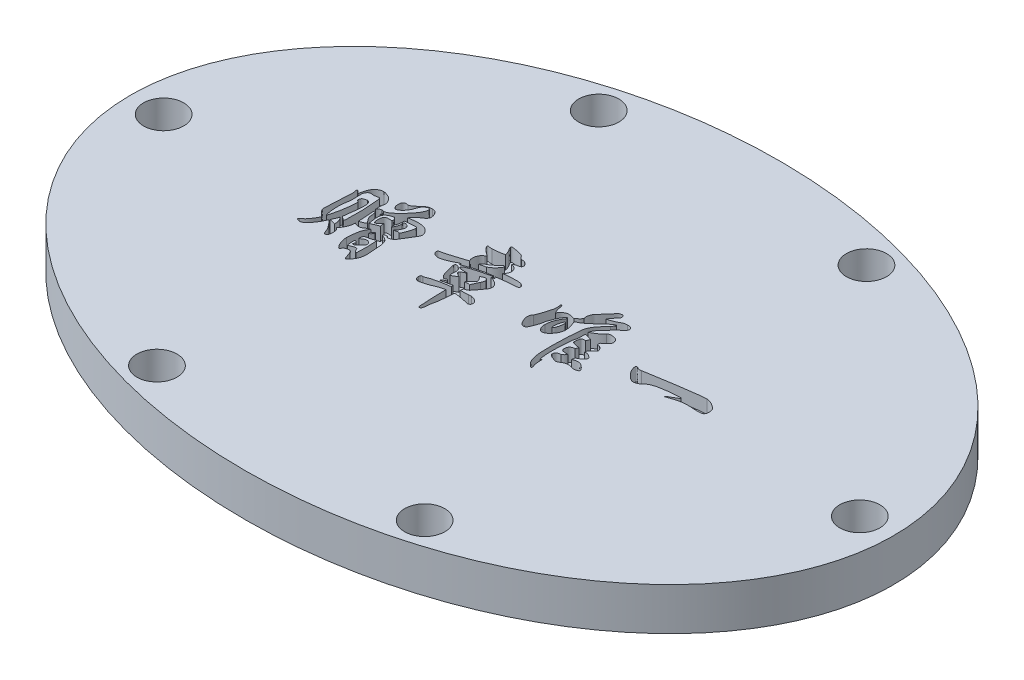
from build123d import *

# Parameters (mm, degrees)
SKETCH1_RX          = 28.5
SKETCH1_RY          = 20
BOSS_EXTRUDE1_DEPTH = 3.175
SKETCH2_R           = 1.5
CUT_EXTRUDE1_DEPTH  = 35.974798284
CUT_EXTRUDE2_DEPTH  = 1


with BuildPart() as part:
    # Sketch1 → Boss-Extrude1 (new body)
    with BuildSketch(Plane(origin=(0, 0, 0), x_dir=(1, 0, 0), z_dir=(0, 1, 0))):
        with Locations(Location((0.015888379, 0), (0, 0, 180))):
            Ellipse(SKETCH1_RX, SKETCH1_RY)
    extrude(amount=BOSS_EXTRUDE1_DEPTH)

    # Sketch2 → Cut-Extrude1 (cut, through all)
    with BuildSketch(Plane(origin=(0, 3.175, 0), x_dir=(1, 0, 0), z_dir=(0, 1, 0))):
        with Locations(Location((-26, 0, 0), (0, 0, 270))):
            Circle(SKETCH2_R)
        with Locations(Location((26, 0, 0), (0, 0, 90))):
            Circle(SKETCH2_R)
        with Locations(Location((-10, 16.5, 0), (0, 0, 270))):
            Circle(SKETCH2_R)
        with Locations(Location((10, 16.5, 0), (0, 0, 90))):
            Circle(SKETCH2_R)
        with Locations(Location((10, -16.5, 0), (0, 0, 270))):
            Circle(SKETCH2_R)
        with Locations(Location((-10, -16.5, 0), (0, 0, 90))):
            Circle(SKETCH2_R)
    extrude(amount=-CUT_EXTRUDE1_DEPTH, mode=Mode.SUBTRACT)

    # Sketch3 → Cut-Extrude2 (cut)
    # profile 1 of 4: a face of its own
    with BuildSketch(Plane(origin=(0, 3.175, 0), x_dir=(1, 0, 0), z_dir=(0, 1, 0))):
        with BuildLine():
            add(Edge.make_bspline(
                [(-10.200151268, 2.424261081), (-10.131059668, 2.436598637), (-9.997889985, 2.460378496), (-9.805294782, 2.486373136), (-9.627655005, 2.501677592), (-9.465408119, 2.507760368), (-9.317594646, 2.503064141), (-9.184561727, 2.48682813), (-9.065021623, 2.462339018), (-8.959490342, 2.423945672), (-8.865082405, 2.376061744), (-8.780886675, 2.317731166), (-8.705479777, 2.249153901), (-8.64184734, 2.171803068), (-8.588851672, 2.092894768), (-8.548598379, 2.016194986), (-8.525061992, 1.942187695), (-8.517904741, 1.872438129), (-8.520876348, 1.808588022), (-8.532921124, 1.75155521), (-8.550797374, 1.700186372), (-8.569461831, 1.67092), (-8.578645892, 1.656519146)],
                knots=[0, 0, 0, 0, 1.896496237, 3.65537638, 5.249631397, 6.712994718, 8.040838151, 9.241022687, 10.331529477, 11.330345698, 12.266019832, 13.184899228, 14.089890479, 15.011318783, 15.884388538, 16.65543245, 17.344762139, 17.96835269, 18.540555482, 19.064844872, 19.539846173, 20, 20, 20, 20], degree=3))
            add(Edge.make_bspline(
                [(-8.578645892, 1.656519146), (-8.590201566, 1.640090412), (-8.617543501, 1.601218309), (-8.662133244, 1.532584928), (-8.716591648, 1.44560353), (-8.781870212, 1.34046815), (-8.85621551, 1.21646528), (-8.941476576, 1.074359216), (-9.036302698, 0.913898645), (-9.102039519, 0.800302795), (-9.136710408, 0.740390113)],
                knots=[0, 0, 0, 0, 0.449249956, 1.06297243, 1.830366366, 2.744785228, 3.830991344, 5.06431333, 6.45166122, 8, 8, 8, 8], degree=3))
            add(Edge.make_bspline(
                [(-9.136710408, 0.740390113), (-9.153060099, 0.713535277), (-9.184965814, 0.661129223), (-9.239627057, 0.590401867), (-9.298483022, 0.528723757), (-9.361342059, 0.47806812), (-9.425281259, 0.43610158), (-9.491187931, 0.408531328), (-9.555592311, 0.388722097), (-9.618019823, 0.384101619), (-9.673302569, 0.387975347), (-9.717390402, 0.408267815), (-9.747867926, 0.443340355), (-9.751832847, 0.473133642), (-9.753914709, 0.48877721)],
                knots=[0, 0, 0, 0, 1.386672815, 2.706032069, 3.936588475, 5.139694072, 6.263107485, 7.297465571, 8.283906395, 9.220514737, 10.048509038, 10.699358491, 11.317071842, 12, 12, 12, 12], degree=3))
            add(Edge.make_bspline(
                [(-9.753914709, 0.48877721), (-9.775070666, 0.486850277), (-9.814701258, 0.483240631), (-9.870780818, 0.474781571), (-9.917980549, 0.457852312), (-9.958092375, 0.439556575), (-9.987846712, 0.41748565), (-10.008026045, 0.395188162), (-10.018642408, 0.371143439), (-10.015601941, 0.35549425), (-10.014129763, 0.347916995)],
                knots=[0, 0, 0, 0, 1.562999369, 2.92790305, 4.153083341, 5.237512277, 6.159957663, 6.851760326, 7.444028379, 8, 8, 8, 8], degree=3))
            add(Edge.make_bspline(
                [(-10.014129763, 0.347916995), (-9.974721655, 0.337116928), (-9.897368235, 0.315917684), (-9.788954434, 0.267072703), (-9.691725207, 0.204589796), (-9.616576114, 0.144222707), (-9.563841743, 0.083481826), (-9.528788644, 0.025459415), (-9.496739212, -0.043382956), (-9.468923357, -0.124219019), (-9.444840226, -0.216337716), (-9.423203821, -0.319627926), (-9.406346124, -0.434577873), (-9.389009668, -0.598830697), (-9.372289782, -0.800669465), (-9.356552985, -1.027921688), (-9.348306285, -1.230864129), (-9.343841823, -1.410518297), (-9.34816042, -1.56912099), (-9.35860393, -1.709474725), (-9.380171067, -1.832459781), (-9.409362921, -1.941488294), (-9.450218921, -2.042479699), (-9.502659331, -2.142072986), (-9.565058276, -2.24578679), (-9.636038905, -2.346410765), (-9.704608941, -2.435857051), (-9.765437436, -2.502946693), (-9.809084619, -2.546420712), (-9.8482215, -2.567107183), (-9.87998373, -2.555963611), (-9.903424756, -2.531207274), (-9.923462363, -2.492531018), (-9.933966923, -2.461939802), (-9.939936214, -2.444556123)],
                knots=[0, 0, 0, 0, 1.112841831, 2.184375932, 3.225355612, 4.258786524, 4.799321956, 5.409398562, 6.100075045, 6.866503495, 7.736390994, 8.694600955, 9.742118397, 10.902137603, 13.197016835, 15.263347324, 17.111823957, 18.73416611, 20.161347722, 21.436188627, 22.567158467, 23.560449852, 24.507635171, 25.530292177, 26.626275068, 27.805438405, 28.884431688, 29.700809449, 30.261546585, 30.586367955, 30.821291947, 31.118482035, 31.499071046, 32, 32, 32, 32], degree=3))
            add(Edge.make_bspline(
                [(-9.939936214, -2.444556123), (-9.95815385, -2.387783326), (-9.991408402, -2.284150012), (-10.042151427, -2.145678895), (-10.084551087, -2.037699235), (-10.121059865, -1.956914973), (-10.158982962, -1.898935129), (-10.201460441, -1.858121356), (-10.251573196, -1.833995529), (-10.309491856, -1.827061571), (-10.37866773, -1.835444801), (-10.463685408, -1.859054595), (-10.569036633, -1.89277689), (-10.644120427, -1.924187782), (-10.685097505, -1.941330317)],
                knots=[0, 0, 0, 0, 1.860980263, 3.39704161, 4.602027269, 5.482758976, 6.159240558, 6.753048918, 7.298514653, 7.863370724, 8.549132827, 9.46086992, 10.614266492, 12, 12, 12, 12], degree=3))
            add(Edge.make_bspline(
                [(-10.685097505, -1.941330317), (-10.688218172, -1.965240288), (-10.693669882, -2.007010271), (-10.7108267, -2.059156586), (-10.736792718, -2.097581833), (-10.76248429, -2.101764827), (-10.774344817, -2.103695908)],
                knots=[0, 0, 0, 0, 1.432667316, 2.502825614, 3.308828749, 4, 4, 4, 4], degree=3))
            add(Edge.make_bspline(
                [(-10.774344817, -2.103695908), (-10.783430248, -2.102347468), (-10.803194591, -2.099414088), (-10.833193491, -2.084020575), (-10.863587997, -2.058687624), (-10.896543848, -2.024518274), (-10.930316754, -1.980028798), (-10.966630789, -1.92659016), (-11.00448025, -1.863304001), (-11.057160938, -1.766619754), (-11.116677485, -1.635981854), (-11.16536499, -1.468971258), (-11.198660422, -1.29641963), (-11.201793308, -1.178408039), (-11.203377075, -1.118749672)],
                knots=[0, 0, 0, 0, 0.29307203, 0.637545566, 1.063024417, 1.558920732, 2.156783254, 2.85184084, 3.630552582, 4.520449768, 6.383244733, 8.219785487, 10.08898919, 12, 12, 12, 12], degree=3))
            add(Edge.make_bspline(
                [(-11.203377075, -1.118749672), (-11.202407765, -1.074997733), (-11.200283091, -0.979095791), (-11.185859891, -0.822811418), (-11.165256318, -0.641036966), (-11.138712573, -0.439763524), (-11.096923141, -0.232419582), (-11.029068942, -0.035476), (-10.937741609, 0.145440305), (-10.857386152, 0.25116315), (-10.817355569, 0.303830974)],
                knots=[0, 0, 0, 0, 0.699321765, 1.532876423, 2.507188468, 3.623665919, 4.777657051, 5.881049203, 6.944404806, 8, 8, 8, 8], degree=3))
            add(Edge.make_bspline(
                [(-10.817355569, 0.303830974), (-10.843364296, 0.298465716), (-10.89653246, 0.287497825), (-10.97490449, 0.256395251), (-11.05285424, 0.211892222), (-11.126655156, 0.154123054), (-11.202821356, 0.097691551), (-11.287165468, 0.0571352), (-11.376168446, 0.033229431), (-11.468239731, 0.026342489), (-11.559876242, 0.032700227), (-11.649823072, 0.052299643), (-11.736054403, 0.08560493), (-11.789431464, 0.117047511), (-11.8162803, 0.132863232)],
                knots=[0, 0, 0, 0, 0.878142067, 1.795136007, 2.778631398, 3.839855157, 4.896888415, 5.910925849, 6.918691258, 7.931059951, 8.95436451, 9.950882184, 10.969287053, 12, 12, 12, 12], degree=3))
            add(Edge.make_bspline(
                [(-11.8162803, 0.132863232), (-11.814850249, 0.09305232), (-11.81187501, 0.010225256), (-11.829043669, -0.119224253), (-11.867373923, -0.255905387), (-11.919715683, -0.397339641), (-11.984386381, -0.534351837), (-12.05744868, -0.658942181), (-12.133033486, -0.770228023), (-12.192839395, -0.832722815), (-12.221656644, -0.862835693)],
                knots=[0, 0, 0, 0, 0.86607187, 1.801872556, 2.827637902, 3.950846968, 5.081618, 6.120034669, 7.094145853, 8, 8, 8, 8], degree=3))
            add(Edge.make_bspline(
                [(-12.221656644, -0.862835693), (-12.206640483, -0.873547784), (-12.176750929, -0.894870118), (-12.137519897, -0.934084518), (-12.104890854, -0.979887887), (-12.07918199, -1.032389878), (-12.058856001, -1.090907528), (-12.043714371, -1.155728808), (-12.035509886, -1.226783952), (-12.034174519, -1.27607774), (-12.033484601, -1.30154537)],
                knots=[0, 0, 0, 0, 0.886223408, 1.764020847, 2.653926408, 3.579206151, 4.56620133, 5.62848355, 6.774756239, 8, 8, 8, 8], degree=3))
            add(Edge.make_bspline(
                [(-12.033484601, -1.30154537), (-12.034243443, -1.334168399), (-12.035654979, -1.394851159), (-12.042243504, -1.479892476), (-12.056202846, -1.551499227), (-12.073779578, -1.6113344), (-12.097850547, -1.658587122), (-12.128709474, -1.692388444), (-12.165485199, -1.714451053), (-12.192685273, -1.716583356), (-12.206602881, -1.717674403)],
                knots=[0, 0, 0, 0, 1.586184401, 2.950493864, 4.13947825, 5.125735994, 5.975273064, 6.690176613, 7.329795612, 8, 8, 8, 8], degree=3))
            add(Edge.make_bspline(
                [(-12.206602881, -1.717674403), (-12.224786578, -1.715299176), (-12.263104243, -1.710293971), (-12.312205735, -1.667990264), (-12.351734712, -1.604977705), (-12.381703125, -1.520069455), (-12.415334255, -1.421121201), (-12.467521579, -1.31530766), (-12.533215378, -1.203761626), (-12.612520681, -1.088514676), (-12.699632966, -0.971349392), (-12.796937013, -0.860223896), (-12.899168246, -0.753476119), (-12.972803777, -0.688153753), (-13.009828687, -0.655308811)],
                knots=[0, 0, 0, 0, 0.47572915, 1.002482086, 1.638302723, 2.433413648, 3.371431322, 4.401028454, 5.543182329, 6.791210975, 8.096594927, 9.3994673, 10.692418083, 12, 12, 12, 12], degree=3))
            add(Edge.make_bspline(
                [(-13.009828687, -0.655308811), (-13.047034059, -0.736529649), (-13.119470536, -0.894661423), (-13.24418197, -1.115850976), (-13.373270916, -1.318187188), (-13.489614494, -1.46908126), (-13.581881222, -1.576974014), (-13.648140345, -1.645344319), (-13.711007784, -1.703613098), (-13.771652449, -1.751013964), (-13.82798044, -1.789809942), (-13.88263739, -1.815529698), (-13.933778981, -1.833646441), (-13.967760392, -1.835934357), (-13.984022236, -1.837029241)],
                knots=[0, 0, 0, 0, 2.035880561, 3.963729195, 5.783773848, 7.50313419, 8.302597937, 9.0191712, 9.672731412, 10.254683261, 10.773680894, 11.226881618, 11.630023312, 12, 12, 12, 12], degree=3))
            add(Edge.make_bspline(
                [(-13.984022236, -1.837029241), (-14.011390634, -1.834951149), (-14.072026764, -1.830347026), (-14.14636888, -1.809812218), (-14.204813842, -1.789110536), (-14.237347035, -1.771014636), (-14.260304537, -1.752871149), (-14.269902723, -1.722321138), (-14.250036499, -1.682001354), (-14.222541533, -1.662381334), (-14.206602881, -1.651007736)],
                knots=[0, 0, 0, 0, 1.577520823, 3.495080601, 4.422859224, 5.13466188, 5.645753682, 6.057058626, 6.8736896, 8, 8, 8, 8], degree=3))
            add(Edge.make_bspline(
                [(-14.206602881, -1.651007736), (-14.175682809, -1.632682671), (-14.11352078, -1.595841772), (-14.02739883, -1.527466149), (-13.944177482, -1.451739771), (-13.87973176, -1.378684672), (-13.826943623, -1.313819378), (-13.785362653, -1.255149423), (-13.74008942, -1.188765268), (-13.692932574, -1.113336043), (-13.643582753, -1.029162657), (-13.591289656, -0.936819652), (-13.534590228, -0.836716909), (-13.497783835, -0.766179279), (-13.478645892, -0.72950236)],
                knots=[0, 0, 0, 0, 1.08442475, 2.180138617, 3.31401494, 4.479191253, 5.118283816, 5.839403063, 6.650114641, 7.545197829, 8.52552107, 9.597062401, 10.750562647, 12, 12, 12, 12], degree=3))
            add(Edge.make_bspline(
                [(-13.478645892, -0.72950236), (-13.503388454, -0.705859048), (-13.550854864, -0.660501454), (-13.618663409, -0.595334206), (-13.67845885, -0.535051995), (-13.731748072, -0.481493313), (-13.776447327, -0.432685804), (-13.815719526, -0.391213762), (-13.846923859, -0.354314118), (-13.87926931, -0.314170704), (-13.910645563, -0.267070514), (-13.936815803, -0.209714999), (-13.952316553, -0.151850243), (-13.956494853, -0.100912984), (-13.956330218, -0.052775718), (-13.953336631, -0.001565221), (-13.951883949, 0.064421196), (-13.948306149, 0.145414131), (-13.944158508, 0.241119753), (-13.938317408, 0.351834697), (-13.933715033, 0.47771139), (-13.92321212, 0.66009255), (-13.911268112, 0.883022704), (-13.899133168, 1.131134583), (-13.885529091, 1.346467062), (-13.875168365, 1.530739508), (-13.865196131, 1.684827041), (-13.857391311, 1.810584433), (-13.852687809, 1.908476717), (-13.851202328, 1.998420344), (-13.853270972, 2.084863367), (-13.872615585, 2.168433952), (-13.890494636, 2.236104815), (-13.89795078, 2.285764589), (-13.892602987, 2.330981377), (-13.869589807, 2.335995623), (-13.859291053, 2.338239576)],
                knots=[0, 0, 0, 0, 1.066644252, 2.046262326, 2.930963584, 3.713016196, 4.400647948, 4.993555584, 5.492764866, 5.906244291, 6.600288719, 7.250228256, 7.862601007, 8.457294988, 8.837110359, 9.362624403, 10.055589166, 10.894087186, 11.889313407, 13.041285472, 14.349490134, 15.814984168, 18.734817172, 21.307651093, 23.557028207, 25.459387826, 27.060007293, 28.369356157, 29.386902423, 30.11310597, 31.175823659, 32.065307881, 32.788756735, 33.327867947, 33.699210534, 34, 34, 34, 34], degree=3))
            add(Edge.make_bspline(
                [(-13.859291053, 2.338239576), (-13.846432015, 2.334969691), (-13.812669049, 2.326384213), (-13.761758679, 2.284370843), (-13.694536391, 2.22411842), (-13.646717363, 2.173497087), (-13.619506107, 2.144691189)],
                knots=[0, 0, 0, 0, 0.5057038, 1.327786711, 2.479386028, 4, 4, 4, 4], degree=3))
            add(Edge.make_bspline(
                [(-13.619506107, 2.144691189), (-13.610671157, 2.195324643), (-13.593615026, 2.29307402), (-13.561279074, 2.43221198), (-13.526070556, 2.559104459), (-13.486670231, 2.672652679), (-13.443609107, 2.773850863), (-13.396727809, 2.862425377), (-13.345205533, 2.938269447), (-13.272838497, 3.020473591), (-13.174151547, 3.101009119), (-13.047888835, 3.172859441), (-12.913476934, 3.217533361), (-12.820910311, 3.222724803), (-12.774344817, 3.22533635)],
                knots=[0, 0, 0, 0, 1.228504381, 2.371663916, 3.413272794, 4.375257719, 5.242694011, 6.040056476, 6.767306416, 7.429068782, 8.652302901, 9.791634792, 10.889085339, 12, 12, 12, 12], degree=3))
            add(Edge.make_bspline(
                [(-12.774344817, 3.22533635), (-12.748419594, 3.224001479), (-12.691160997, 3.221053276), (-12.599770931, 3.196552469), (-12.494117434, 3.162688047), (-12.380389074, 3.114337608), (-12.265929865, 3.056846451), (-12.166330055, 2.981869836), (-12.083449499, 2.895830214), (-12.021915982, 2.799704489), (-11.976728434, 2.704455979), (-11.940868849, 2.618408386), (-11.919455461, 2.542227105), (-11.912498444, 2.475960745), (-11.916050445, 2.420596317), (-11.919273827, 2.374100036), (-11.927128938, 2.335768476), (-11.941494442, 2.304878439), (-11.953870079, 2.271287672), (-11.961929626, 2.22783191), (-11.965079805, 2.171626065), (-11.968342216, 2.0791086), (-11.963210468, 1.95168412), (-11.955642618, 1.84753098), (-11.951764171, 1.794153554)],
                knots=[0, 0, 0, 0, 0.886457294, 1.957834717, 3.222711844, 4.685600505, 6.183922226, 7.59490076, 8.931418533, 10.251788378, 11.480932738, 12.538094747, 13.439873205, 14.179707576, 14.805926849, 15.335787886, 15.776291042, 16.134001823, 16.498796673, 16.999291079, 17.639183577, 18.424807129, 20.16774998, 22, 22, 22, 22], degree=3))
            add(Edge.make_bspline(
                [(-11.951764171, 1.794153554), (-11.930140704, 1.821276927), (-11.890025188, 1.871595781), (-11.820027608, 1.928186659), (-11.74945364, 1.967625403), (-11.699520177, 1.971738355), (-11.675420085, 1.973723447)],
                knots=[0, 0, 0, 0, 1.2159829, 2.255872305, 3.158207043, 4, 4, 4, 4], degree=3))
            add(Edge.make_bspline(
                [(-11.675420085, 1.973723447), (-11.659128849, 1.973574064), (-11.628547497, 1.973293649), (-11.58726929, 1.958896512), (-11.549253527, 1.946477092), (-11.523546854, 1.944559177), (-11.510903956, 1.94361592)],
                knots=[0, 0, 0, 0, 1.154273861, 2.166763431, 3.098388842, 4, 4, 4, 4], degree=3))
            add(Edge.make_bspline(
                [(-11.510903956, 1.94361592), (-11.48339157, 1.945966424), (-11.423068706, 1.951120073), (-11.330352003, 1.988844528), (-11.226386686, 2.042410454), (-11.113797653, 2.121221744), (-10.988902374, 2.21872766), (-10.855498947, 2.340048519), (-10.710832574, 2.481912895), (-10.560057151, 2.639638476), (-10.414792266, 2.80446947), (-10.281831182, 2.962637259), (-10.172994563, 3.114179015), (-10.079410366, 3.253031079), (-10.009642247, 3.384724166), (-9.957520467, 3.505706267), (-9.924919519, 3.617898244), (-9.920496926, 3.690393648), (-9.918430838, 3.724261081)],
                knots=[0, 0, 0, 0, 0.531157527, 1.164600682, 1.914619445, 2.792906188, 3.814509399, 4.977478461, 6.275976058, 7.731584245, 9.19434914, 10.523381439, 11.723632296, 12.79988959, 13.757748242, 14.599380975, 15.345677537, 16, 16, 16, 16], degree=3))
            add(Edge.make_bspline(
                [(-9.918430838, 3.724261081), (-9.918948086, 3.742046296), (-9.919859946, 3.773399987), (-9.937584104, 3.813948973), (-9.968694206, 3.840285267), (-9.994287627, 3.84247188), (-10.00767815, 3.84361592)],
                knots=[0, 0, 0, 0, 1.255475411, 2.213287163, 3.065188696, 4, 4, 4, 4], degree=3))
            add(Edge.make_bspline(
                [(-10.00767815, 3.84361592), (-10.030451389, 3.842154836), (-10.077538415, 3.83913383), (-10.147152616, 3.813451018), (-10.216778249, 3.77332259), (-10.286698852, 3.720725166), (-10.351185424, 3.65453316), (-10.408336575, 3.578492854), (-10.453667518, 3.491421113), (-10.475161117, 3.42852645), (-10.486172774, 3.396304092)],
                knots=[0, 0, 0, 0, 0.784078581, 1.621197897, 2.529498423, 3.55371082, 4.629579067, 5.708216973, 6.825867743, 8, 8, 8, 8], degree=3))
            add(Edge.make_bspline(
                [(-10.486172774, 3.396304092), (-10.507770859, 3.331272179), (-10.549244259, 3.206395622), (-10.630298551, 3.034848877), (-10.721766863, 2.885111122), (-10.823509273, 2.76133828), (-10.925427764, 2.664313956), (-11.016581553, 2.591275688), (-11.097240463, 2.544460808), (-11.17069536, 2.528004093), (-11.232663422, 2.536506285), (-11.285647178, 2.558571376), (-11.330499473, 2.595693956), (-11.364337798, 2.647822227), (-11.389371324, 2.710575059), (-11.407275742, 2.782623971), (-11.419245486, 2.862911806), (-11.421668374, 2.948668267), (-11.417825947, 3.03256703), (-11.402238402, 3.108070083), (-11.375383745, 3.171572187), (-11.337371861, 3.221138065), (-11.294312022, 3.257769636), (-11.249901147, 3.282754391), (-11.203757678, 3.293476557), (-11.147954574, 3.287134789), (-11.092108811, 3.273030729), (-11.049320313, 3.270444506), (-11.032409333, 3.269422371)],
                knots=[0, 0, 0, 0, 2.312836053, 4.441188831, 6.39309426, 8.225355365, 9.835123569, 11.137976053, 12.167037103, 12.957682474, 13.628916782, 14.24730222, 14.875096878, 15.563471842, 16.32339613, 17.148512254, 18.066221327, 19.059626739, 20.042127913, 20.896994518, 21.650527077, 22.350305348, 22.985873052, 23.549187857, 24.057376747, 24.55507437, 25.428932793, 26, 26, 26, 26], degree=3))
            add(Edge.make_bspline(
                [(-11.032409333, 3.269422371), (-11.010749515, 3.270680599), (-10.965452999, 3.273311891), (-10.897162033, 3.295941714), (-10.825626028, 3.329170144), (-10.751746218, 3.378662827), (-10.671808721, 3.441089264), (-10.583163546, 3.516402607), (-10.484211778, 3.604646259), (-10.38238728, 3.707098172), (-10.268624518, 3.805057194), (-10.136597949, 3.87483982), (-9.993469777, 3.917640015), (-9.894001599, 3.922733168), (-9.843162021, 3.92533635)],
                knots=[0, 0, 0, 0, 0.557345957, 1.165560593, 1.839539412, 2.588165294, 3.451532674, 4.455111297, 5.587331546, 6.868612626, 8.182289646, 9.439337545, 10.691209583, 12, 12, 12, 12], degree=3))
            add(Edge.make_bspline(
                [(-9.843162021, 3.92533635), (-9.805886364, 3.923380507), (-9.733653043, 3.919590445), (-9.632553513, 3.880792381), (-9.544368647, 3.818734519), (-9.474849438, 3.732560069), (-9.417900393, 3.636900349), (-9.376395334, 3.535385097), (-9.350518829, 3.431283815), (-9.347045686, 3.360605448), (-9.345312558, 3.32533635)],
                knots=[0, 0, 0, 0, 1.03009745, 1.99613816, 2.959102953, 3.989200403, 5.041475494, 6.040528631, 7.022207342, 8, 8, 8, 8], degree=3))
            add(Edge.make_bspline(
                [(-9.345312558, 3.32533635), (-9.346333511, 3.312371087), (-9.348496619, 3.284901384), (-9.360898459, 3.242122433), (-9.383415433, 3.197305887), (-9.420446908, 3.13549483), (-9.475394449, 3.064729035), (-9.533125559, 3.025545677), (-9.560366322, 3.00705678)],
                knots=[0, 0, 0, 0, 0.588259981, 1.246355544, 2.001849536, 2.854133574, 4.515604523, 6, 6, 6, 6], degree=3))
            add(Edge.make_bspline(
                [(-9.560366322, 3.00705678), (-9.583849974, 2.993742918), (-9.632939663, 2.965911925), (-9.706208241, 2.915895194), (-9.78201079, 2.856663384), (-9.861360605, 2.7888964), (-9.940788964, 2.709334231), (-10.026548096, 2.624048268), (-10.113485816, 2.528027781), (-10.170643652, 2.459591284), (-10.200151268, 2.424261081)],
                knots=[0, 0, 0, 0, 0.74410336, 1.555456621, 2.443039969, 3.396000269, 4.430347618, 5.54149266, 6.730800575, 8, 8, 8, 8], degree=3))
        make_face()
        with BuildLine():
            add(Edge.make_bspline(
                [(-12.728108257, 0.082325597), (-12.697233859, 0.056121559), (-12.642519068, 0.009683458), (-12.567715144, -0.045740244), (-12.513741744, -0.082317635), (-12.467653702, -0.098460857), (-12.429788549, -0.093220971), (-12.401396623, -0.072643562), (-12.393848689, -0.03821322), (-12.389904204, 0.007189691), (-12.384007075, 0.074775077), (-12.380228306, 0.165781635), (-12.377001159, 0.284108589), (-12.375408986, 0.433218238), (-12.372595602, 0.614575994), (-12.373168866, 0.825340088), (-12.374636055, 1.058348158), (-12.381437528, 1.307121765), (-12.392140052, 1.567722398), (-12.404576578, 1.789910588), (-12.415851449, 1.964790781), (-12.424236483, 2.084527617), (-12.433450206, 2.19089739), (-12.439879188, 2.284618658), (-12.449489637, 2.365091244), (-12.455750314, 2.432736252), (-12.464992455, 2.486704374), (-12.47402962, 2.538668704), (-12.486528774, 2.587720314), (-12.504968395, 2.631804026), (-12.527393307, 2.662183025), (-12.558193527, 2.671779127), (-12.589866465, 2.666637409), (-12.627338797, 2.662330392), (-12.671955826, 2.651532384), (-12.737835624, 2.635217691), (-12.817127205, 2.616772188), (-12.904000074, 2.608321358), (-12.975995609, 2.612566985), (-13.03590661, 2.619479294), (-13.085428056, 2.63089291), (-13.116229989, 2.631507876), (-13.130258795, 2.631787963)],
                knots=[0, 0, 0, 0, 1.296040101, 2.296807879, 2.981758427, 3.377492265, 3.830344552, 4.156570078, 4.421527363, 4.918345055, 5.632202715, 6.585863888, 7.837284163, 9.421217687, 11.360894498, 13.644732715, 16.169683315, 18.821666027, 21.612833934, 24.520849218, 25.946903009, 27.224106995, 28.36399138, 29.365680009, 30.231305877, 30.958779458, 31.539906747, 31.983354199, 32.648698614, 33.152100448, 33.518093412, 33.808430319, 34.130593102, 34.536351266, 35.018094043, 35.597064165, 36.711237958, 37.621439533, 38.379675504, 39.015978827, 39.55182546, 40, 40, 40, 40], degree=3))
            add(Edge.make_bspline(
                [(-13.130258795, 2.631787963), (-13.153473082, 2.630255206), (-13.199750494, 2.627199672), (-13.264890697, 2.598464381), (-13.322248371, 2.552444788), (-13.37029892, 2.491384229), (-13.407923651, 2.422186365), (-13.438349373, 2.351612089), (-13.456064417, 2.280002345), (-13.461033328, 2.189876684), (-13.45802285, 2.091926038), (-13.452947586, 2.000580033), (-13.44762725, 1.926828513), (-13.446435109, 1.854004554), (-13.443492397, 1.759765545), (-13.444093935, 1.649339861), (-13.445667579, 1.533169145), (-13.450707974, 1.421941459), (-13.460092368, 1.321094791), (-13.469766256, 1.257558174), (-13.474344817, 1.227486888)],
                knots=[0, 0, 0, 0, 0.794140261, 1.58310941, 2.398443024, 3.300295314, 4.231914222, 5.098533907, 5.934705094, 6.749666749, 8.190453987, 9.300298742, 9.892457784, 10.730078141, 11.801559272, 13.131322454, 14.522866653, 15.792560096, 16.955239374, 18, 18, 18, 18], degree=3))
            add(Edge.make_bspline(
                [(-13.474344817, 1.227486888), (-13.484937526, 1.170229167), (-13.505786791, 1.057530777), (-13.52702071, 0.889541112), (-13.540275809, 0.725920879), (-13.545625224, 0.513101448), (-13.535065403, 0.247332222), (-13.505447175, -0.012215551), (-13.475768959, -0.204231783), (-13.450520744, -0.314197054), (-13.430238268, -0.394048472), (-13.406179226, -0.430525907), (-13.396925462, -0.444556123)],
                knots=[0, 0, 0, 0, 1.030739219, 2.02876835, 2.99631359, 3.935817857, 5.796413267, 7.69898666, 8.56069231, 9.23039507, 9.703988947, 10, 10, 10, 10], degree=3))
            add(Edge.make_bspline(
                [(-13.396925462, -0.444556123), (-13.367045075, -0.346230178), (-13.307941966, -0.151742435), (-13.23509832, 0.14069278), (-13.176629642, 0.429880896), (-13.140322496, 0.66719282), (-13.118046578, 0.848986647), (-13.10219873, 0.971438578), (-13.091451148, 1.080957936), (-13.079409746, 1.177168522), (-13.072992535, 1.260501236), (-13.065593621, 1.330258267), (-13.062430893, 1.386950716), (-13.060968103, 1.442541628), (-13.062092666, 1.496675135), (-13.064496874, 1.548570782), (-13.069975102, 1.585075152), (-13.080764067, 1.615874745), (-13.113968516, 1.637051088), (-13.151410523, 1.640908441), (-13.18740568, 1.650793411), (-13.205813474, 1.677331767), (-13.218070954, 1.712375707), (-13.218300592, 1.739857067), (-13.218430838, 1.755443877)],
                knots=[0, 0, 0, 0, 2.926569684, 5.788725815, 8.57957581, 11.327091463, 12.623685602, 13.796192128, 14.843491878, 15.757761323, 16.557220753, 17.22359118, 17.755313443, 18.173984504, 18.806990931, 19.2979528, 19.650403255, 19.860855912, 20.20386602, 20.686694567, 20.948357757, 21.224174978, 21.559969477, 22, 22, 22, 22], degree=3))
            add(Edge.make_bspline(
                [(-13.218430838, 1.755443877), (-13.217330296, 1.783044172), (-13.215261544, 1.834926022), (-13.185213249, 1.904367212), (-13.139853918, 1.961465028), (-13.074334985, 1.99480851), (-13.007395979, 2.018713834), (-12.943377929, 2.037123589), (-12.88565205, 2.050469248), (-12.848600519, 2.05166216), (-12.831334064, 2.05221807)],
                knots=[0, 0, 0, 0, 1.199851262, 2.255428961, 3.258559586, 4.327711794, 5.415606447, 6.379638922, 7.244892462, 8, 8, 8, 8], degree=3))
            add(Edge.make_bspline(
                [(-12.831334064, 2.05221807), (-12.811384758, 2.051266248), (-12.773156021, 2.049442276), (-12.720254655, 2.027126044), (-12.674964287, 1.993235852), (-12.638564373, 1.94475918), (-12.61228985, 1.88270257), (-12.59356936, 1.807970854), (-12.582222713, 1.720313392), (-12.578618979, 1.61854543), (-12.581366582, 1.499792981), (-12.589825303, 1.360779999), (-12.599856889, 1.200087439), (-12.616491628, 1.01800868), (-12.638316681, 0.814842338), (-12.664246379, 0.589760247), (-12.694204445, 0.343140752), (-12.716508979, 0.171556498), (-12.728108257, 0.082325597)],
                knots=[0, 0, 0, 0, 0.451534814, 0.865273507, 1.284767728, 1.72713753, 2.227645782, 2.809621755, 3.476755351, 4.236458383, 5.126190298, 6.180547441, 7.407460519, 8.792143124, 10.343241913, 12.060163899, 13.951122452, 16, 16, 16, 16], degree=3))
        make_face(mode=Mode.SUBTRACT)
        with BuildLine():
            add(Edge.make_bspline(
                [(-9.509828687, 1.096304092), (-9.485878043, 1.14850189), (-9.439884583, 1.248739582), (-9.378425574, 1.395002532), (-9.326783952, 1.531038201), (-9.282785519, 1.656418933), (-9.25082173, 1.772703568), (-9.227116374, 1.878141311), (-9.210078109, 1.973173643), (-9.208445771, 2.033518025), (-9.20767815, 2.06189549)],
                knots=[0, 0, 0, 0, 1.353672245, 2.599515422, 3.738664628, 4.78332041, 5.730315302, 6.578882439, 7.33170725, 8, 8, 8, 8], degree=3))
            add(Edge.make_bspline(
                [(-9.20767815, 2.06189549), (-9.20811165, 2.079259403), (-9.208862879, 2.109350024), (-9.233181652, 2.141138335), (-9.261631164, 2.151370015), (-9.291587913, 2.15766844), (-9.330878596, 2.161615663), (-9.381530695, 2.162367351), (-9.447512287, 2.159589775), (-9.532883764, 2.154435524), (-9.639968397, 2.143901148), (-9.760500069, 2.132393098), (-9.878472784, 2.118330541), (-9.97698037, 2.104267607), (-10.049322194, 2.09318667), (-10.087317773, 2.081541624), (-10.102301806, 2.076949253)],
                knots=[0, 0, 0, 0, 0.744506516, 1.290185131, 1.613183999, 2.046532453, 2.629616851, 3.334839505, 4.259767502, 5.515632916, 7.073136156, 8.962642991, 10.808846093, 12.264598124, 13.315622506, 14, 14, 14, 14], degree=3))
            add(Edge.make_bspline(
                [(-10.102301806, 2.076949253), (-10.103090735, 2.034619499), (-10.104638976, 1.951549097), (-10.117863692, 1.830061336), (-10.138788321, 1.714469588), (-10.169382394, 1.608315056), (-10.200214652, 1.514409021), (-10.221716264, 1.434775582), (-10.235752295, 1.372751409), (-10.24108701, 1.318309616), (-10.240195314, 1.274739855), (-10.234408235, 1.246811113), (-10.232409333, 1.237164307)],
                knots=[0, 0, 0, 0, 1.482898013, 2.910126389, 4.277290805, 5.593666718, 6.777482624, 7.740248724, 8.484140382, 9.001533703, 9.655121938, 10, 10, 10, 10], degree=3))
            add(Edge.make_bspline(
                [(-10.232409333, 1.237164307), (-10.222203587, 1.238331198), (-10.195291129, 1.24140828), (-10.164226833, 1.28753685), (-10.124508333, 1.348875917), (-10.083091428, 1.435750714), (-10.045474396, 1.529370666), (-10.019330622, 1.619574467), (-10.008634781, 1.700287352), (-10.015328768, 1.749734026), (-10.018430838, 1.772648178)],
                knots=[0, 0, 0, 0, 0.39284535, 1.035929535, 2.025078653, 3.371703394, 4.806523333, 6.029827101, 7.086999416, 8, 8, 8, 8], degree=3))
            add(Edge.make_bspline(
                [(-10.018430838, 1.772648178), (-10.022523667, 1.79121433), (-10.03003137, 1.825271244), (-10.032404971, 1.860053363), (-10.033484601, 1.875873984)],
                knots=[0, 0, 0, 0, 1.090301462, 2, 2, 2, 2], degree=3))
            add(Edge.make_bspline(
                [(-10.033484601, 1.875873984), (-10.032588783, 1.891036307), (-10.030972552, 1.918392098), (-10.016635238, 1.954751755), (-9.988009762, 1.977307859), (-9.949852364, 1.981857451), (-9.906491933, 1.976275839), (-9.855954295, 1.96455943), (-9.800710275, 1.941909316), (-9.741779178, 1.914533714), (-9.684730508, 1.881295643), (-9.643986467, 1.834005182), (-9.61619745, 1.780065233), (-9.614122392, 1.740382264), (-9.613054494, 1.719960006)],
                knots=[0, 0, 0, 0, 0.882805972, 1.592754351, 2.202339823, 2.90240158, 3.762208653, 4.749381234, 5.912223875, 7.228637843, 8.542899047, 9.711161152, 10.822082672, 12, 12, 12, 12], degree=3))
            add(Edge.make_bspline(
                [(-9.613054494, 1.719960006), (-9.613755979, 1.697646497), (-9.615208197, 1.651452981), (-9.632112703, 1.581416891), (-9.655179338, 1.507491272), (-9.690851822, 1.431600412), (-9.733534111, 1.351195801), (-9.788233228, 1.269189754), (-9.850303817, 1.182237399), (-9.897935542, 1.125724086), (-9.922731913, 1.096304092)],
                knots=[0, 0, 0, 0, 0.753068387, 1.559005253, 2.425301052, 3.36926665, 4.388878036, 5.50170795, 6.699426152, 8, 8, 8, 8], degree=3))
            add(Edge.make_bspline(
                [(-9.922731913, 1.096304092), (-9.89125917, 1.105169269), (-9.83459594, 1.12113005), (-9.758028437, 1.139030879), (-9.700280322, 1.152113679), (-9.644091415, 1.158242539), (-9.578227896, 1.142026895), (-9.534369589, 1.112708943), (-9.509828687, 1.096304092)],
                knots=[0, 0, 0, 0, 1.358106525, 2.445122126, 3.265652324, 3.818361635, 4.779264915, 6, 6, 6, 6], degree=3))
        make_face(mode=Mode.SUBTRACT)
        with BuildLine():
            add(Edge.make_bspline(
                [(-10.601226537, 1.641465382), (-10.596213743, 1.658188087), (-10.586738141, 1.689798744), (-10.584891816, 1.722729761), (-10.584022236, 1.738239576)],
                knots=[0, 0, 0, 0, 1.058042203, 2, 2, 2, 2], degree=3))
            add(Edge.make_bspline(
                [(-10.584022236, 1.738239576), (-10.585244188, 1.760028082), (-10.587690768, 1.803652811), (-10.61507358, 1.865095404), (-10.655215247, 1.923160579), (-10.693116332, 1.953475153), (-10.713054494, 1.969422371)],
                knots=[0, 0, 0, 0, 0.945320571, 1.892711378, 2.891444336, 4, 4, 4, 4], degree=3))
            add(Edge.make_bspline(
                [(-10.713054494, 1.969422371), (-10.759533521, 1.958866297), (-10.849037472, 1.938538626), (-10.974676513, 1.894409486), (-11.085999593, 1.839898556), (-11.186123913, 1.779142031), (-11.269077017, 1.700384468), (-11.32801928, 1.599308072), (-11.359914804, 1.477493143), (-11.369913199, 1.337623466), (-11.361907521, 1.18027872), (-11.347383103, 1.005130215), (-11.320880092, 0.812590824), (-11.297380508, 0.67902229), (-11.285097505, 0.609207318)],
                knots=[0, 0, 0, 0, 0.985821804, 1.898381963, 2.747614021, 3.548021881, 4.313830414, 5.08853133, 5.936207185, 6.896501852, 7.980051914, 9.193511236, 10.533075661, 12, 12, 12, 12], degree=3))
            add(Edge.make_bspline(
                [(-11.285097505, 0.609207318), (-11.246563548, 0.628929587), (-11.162601193, 0.671902805), (-11.021758162, 0.733377284), (-10.857736212, 0.801216157), (-10.739360723, 0.845764302), (-10.676495354, 0.869422371)],
                knots=[0, 0, 0, 0, 0.784139898, 1.708577022, 2.783099857, 4, 4, 4, 4], degree=3))
            add(Edge.make_bspline(
                [(-10.676495354, 0.869422371), (-10.680986787, 0.889815554), (-10.690713543, 0.933979524), (-10.702155948, 1.006518247), (-10.712827086, 1.090073585), (-10.718600357, 1.149690156), (-10.721656644, 1.181250328)],
                knots=[0, 0, 0, 0, 0.794553149, 1.720703479, 2.793372563, 4, 4, 4, 4], degree=3))
            add(Edge.make_bspline(
                [(-10.721656644, 1.181250328), (-10.743015531, 1.15674496), (-10.783371813, 1.110443596), (-10.842598577, 1.04704102), (-10.895744351, 0.992882712), (-10.944803947, 0.949756839), (-10.987459877, 0.914618475), (-11.025497727, 0.889508223), (-11.05894355, 0.874596221), (-11.087767189, 0.867685387), (-11.114053954, 0.87203674), (-11.135376722, 0.887633864), (-11.152966477, 0.911619997), (-11.166421059, 0.944864528), (-11.17674047, 0.986882516), (-11.183578233, 1.037723164), (-11.189558139, 1.097241299), (-11.189533121, 1.184880494), (-11.18760009, 1.289862146), (-11.174761423, 1.401191444), (-11.152219963, 1.48899293), (-11.119885246, 1.555958079), (-11.075197635, 1.602275079), (-11.023085524, 1.63459032), (-10.961920732, 1.652843218), (-10.869737442, 1.659022887), (-10.74865398, 1.65447878), (-10.650655206, 1.645828443), (-10.601226537, 1.641465382)],
                knots=[0, 0, 0, 0, 1.427990458, 2.698098846, 3.811543813, 4.759608041, 5.566221882, 6.238912219, 6.753752605, 7.170663038, 7.522765253, 7.88527667, 8.300995928, 8.815836314, 9.449815883, 10.198064157, 11.067692476, 12.075590832, 14.044909567, 15.679665207, 16.986149477, 18.014384406, 18.905418698, 19.775047018, 20.681530734, 21.678048429, 23.820091994, 26, 26, 26, 26], degree=3))
        make_face(mode=Mode.SUBTRACT)
        with BuildLine():
            add(Edge.make_bspline(
                [(-11.337785677, 1.740390113), (-11.349895336, 1.74860102), (-11.373317099, 1.764482052), (-11.414333864, 1.770542107), (-11.451646367, 1.769396263), (-11.475089146, 1.765033467), (-11.486172774, 1.762970759)],
                knots=[0, 0, 0, 0, 1.116791162, 2.16002917, 3.130071131, 4, 4, 4, 4], degree=3))
            add(Edge.make_bspline(
                [(-11.486172774, 1.762970759), (-11.472730085, 1.738085839), (-11.446226937, 1.689023576), (-11.442733172, 1.633394773), (-11.441011483, 1.605981511)],
                knots=[0, 0, 0, 0, 1.014421998, 2, 2, 2, 2], degree=3))
            add(Edge.make_bspline(
                [(-11.441011483, 1.605981511), (-11.417805555, 1.62302566), (-11.370450487, 1.657806722), (-11.348817574, 1.712499197), (-11.337785677, 1.740390113)],
                knots=[0, 0, 0, 0, 0.980082142, 2, 2, 2, 2], degree=3))
        make_face(mode=Mode.SUBTRACT)
        with BuildLine():
            add(Edge.make_bspline(
                [(-11.333484601, 0.566196565), (-11.366237862, 0.59943918), (-11.427736709, 0.661856859), (-11.507161553, 0.75667884), (-11.574246367, 0.84151986), (-11.624221716, 0.923727954), (-11.661676964, 1.003803381), (-11.68914769, 1.085613643), (-11.706108956, 1.170579908), (-11.713422095, 1.256430285), (-11.717783227, 1.337513721), (-11.728900115, 1.409354386), (-11.742586211, 1.470193116), (-11.763699428, 1.518646043), (-11.784813586, 1.556687774), (-11.806056611, 1.58454651), (-11.827759624, 1.602212084), (-11.849707819, 1.608692583), (-11.869381291, 1.604751572), (-11.883113814, 1.589722513), (-11.891285306, 1.567687055), (-11.891454752, 1.550154287), (-11.891549118, 1.540390113)],
                knots=[0, 0, 0, 0, 2.163003222, 4.061342289, 5.733446945, 7.17294581, 8.511409931, 9.825399, 11.165100912, 12.517935459, 13.818187233, 14.927679641, 15.887089639, 16.698960517, 17.368966108, 17.901091124, 18.316610952, 18.643157725, 18.933427398, 19.191986259, 19.5500091, 20, 20, 20, 20], degree=3))
            Line((-11.891549118, 1.540390113), (-11.846387827, 1.012433124))
            add(Edge.make_bspline(
                [(-11.846387827, 1.012433124), (-11.839218248, 0.906015308), (-11.824864084, 0.692956936), (-11.819143555, 0.479492152), (-11.8162803, 0.372648178)],
                knots=[0, 0, 0, 0, 0.998954557, 2, 2, 2, 2], degree=3))
            add(Edge.make_bspline(
                [(-11.8162803, 0.372648178), (-11.785616712, 0.377949932), (-11.716471518, 0.389905181), (-11.605065896, 0.430384068), (-11.474721813, 0.489798675), (-11.383000374, 0.539412543), (-11.333484601, 0.566196565)],
                knots=[0, 0, 0, 0, 0.713009945, 1.607809531, 2.708577187, 4, 4, 4, 4], degree=3))
        make_face(mode=Mode.SUBTRACT)
        with BuildLine():
            add(Edge.make_bspline(
                [(-10.447463096, 0.260820221), (-10.476765176, 0.244256622), (-10.533765001, 0.212036309), (-10.596997203, 0.133697629), (-10.634716829, 0.036044571), (-10.638126915, -0.035584135), (-10.639936214, -0.073588381)],
                knots=[0, 0, 0, 0, 0.980295014, 1.906917305, 2.88946717, 4, 4, 4, 4], degree=3))
            add(Edge.make_bspline(
                [(-10.639936214, -0.073588381), (-10.606494781, -0.045307295), (-10.547017999, 0.004991626), (-10.478709391, 0.080943116), (-10.429804841, 0.142300861), (-10.420981643, 0.184385068), (-10.417355569, 0.201680436)],
                knots=[0, 0, 0, 0, 1.453217256, 2.584598712, 3.418311795, 4, 4, 4, 4], degree=3))
            add(Edge.make_bspline(
                [(-10.417355569, 0.201680436), (-10.418618692, 0.213425105), (-10.421149306, 0.236955073), (-10.438681742, 0.25285602), (-10.447463096, 0.260820221)],
                knots=[0, 0, 0, 0, 0.998273305, 2, 2, 2, 2], degree=3))
        make_face(mode=Mode.SUBTRACT)
        with BuildLine():
            add(Edge.make_bspline(
                [(-12.527032989, -0.704771177), (-12.527211875, -0.671418234), (-12.527560873, -0.606348228), (-12.537083287, -0.511229127), (-12.555468092, -0.421616407), (-12.581530628, -0.337063689), (-12.61446027, -0.256951278), (-12.656971174, -0.182673433), (-12.706280357, -0.113045682), (-12.745164617, -0.071730013), (-12.764667397, -0.051007736)],
                knots=[0, 0, 0, 0, 1.118335597, 2.18181962, 3.200388783, 4.181517329, 5.146080224, 6.098959239, 7.046514442, 8, 8, 8, 8], degree=3))
            add(Edge.make_bspline(
                [(-12.764667397, -0.051007736), (-12.774327171, -0.08267845), (-12.79653623, -0.155493487), (-12.844449679, -0.275837714), (-12.906698298, -0.42270897), (-12.954738008, -0.528893434), (-12.980796429, -0.586491607)],
                knots=[0, 0, 0, 0, 0.687291363, 1.580171071, 2.68740002, 4, 4, 4, 4], degree=3))
            add(Edge.make_bspline(
                [(-12.980796429, -0.586491607), (-12.951403498, -0.593651278), (-12.895489258, -0.607271137), (-12.815960087, -0.626787454), (-12.745116682, -0.643422659), (-12.683984752, -0.659826973), (-12.632004611, -0.673787771), (-12.589071987, -0.685861152), (-12.554654759, -0.694744622), (-12.535241377, -0.701791576), (-12.527032989, -0.704771177)],
                knots=[0, 0, 0, 0, 1.547908057, 2.944588983, 4.19004345, 5.270974799, 6.182975691, 6.943781186, 7.553408398, 8, 8, 8, 8], degree=3))
        make_face(mode=Mode.SUBTRACT)
        with BuildLine():
            add(Edge.make_bspline(
                [(-10.684022236, -1.597244295), (-10.653615046, -1.584907656), (-10.595878921, -1.56148327), (-10.512862984, -1.530480555), (-10.438678091, -1.503560474), (-10.373302678, -1.480650605), (-10.316632999, -1.463320664), (-10.268511143, -1.451375431), (-10.229470521, -1.443116745), (-10.190136468, -1.440432654), (-10.151770499, -1.44276196), (-10.115061333, -1.451795071), (-10.0867784, -1.467553733), (-10.079042814, -1.484845255), (-10.075420085, -1.49294322)],
                knots=[0, 0, 0, 0, 1.806483359, 3.430088356, 4.878257266, 6.151282706, 7.24373199, 8.138691095, 8.88175157, 9.435674258, 10.305927896, 10.980889357, 11.522730174, 12, 12, 12, 12], degree=3))
            add(Edge.make_bspline(
                [(-10.075420085, -1.49294322), (-10.065190003, -1.529303217), (-10.047113628, -1.593550691), (-10.007352117, -1.673109163), (-9.956599769, -1.727920023), (-9.914282393, -1.73489102), (-9.894774924, -1.73810451)],
                knots=[0, 0, 0, 0, 1.389080244, 2.454480317, 3.287546161, 4, 4, 4, 4], degree=3))
            add(Edge.make_bspline(
                [(-9.894774924, -1.73810451), (-9.885824874, -1.737819667), (-9.86984716, -1.737311162), (-9.850908093, -1.720106988), (-9.847828344, -1.689097243), (-9.841410157, -1.642811143), (-9.838668027, -1.570619292), (-9.832162976, -1.440769776), (-9.82901914, -1.259592185), (-9.825978009, -1.032385949), (-9.829336744, -0.794858364), (-9.84322809, -0.593597679), (-9.854035721, -0.439807972), (-9.862092114, -0.348016998), (-9.870603819, -0.281558997), (-9.879178625, -0.231403589), (-9.890102787, -0.193612347), (-9.922470895, -0.170957488), (-9.957225736, -0.189545754), (-9.980881225, -0.215509352), (-10.0097736, -0.241456728), (-10.043543571, -0.260652677), (-10.086320384, -0.279279366), (-10.15809587, -0.306415586), (-10.265838992, -0.333570646), (-10.381845762, -0.348419232), (-10.477556935, -0.362109156), (-10.540928462, -0.384258849), (-10.594593014, -0.412601999), (-10.637494978, -0.450538752), (-10.669436169, -0.49868614), (-10.685183655, -0.5589735), (-10.691861105, -0.628772395), (-10.686756711, -0.678260108), (-10.684022236, -0.704771177)],
                knots=[0, 0, 0, 0, 0.31522002, 0.562733794, 0.842403804, 1.403242192, 2.27280376, 3.439946462, 6.109557863, 8.817373609, 11.655093233, 14.692092527, 16.108036328, 17.227016403, 18.024066981, 18.524657757, 19.075836204, 19.406898353, 19.77991671, 20.339406747, 20.716007596, 21.169263686, 21.737534659, 22.401683807, 23.941423011, 25.737052057, 26.631635926, 27.426472324, 28.151283879, 28.811885467, 29.476666115, 30.206324418, 31.039109805, 32, 32, 32, 32], degree=3))
            add(Edge.make_bspline(
                [(-10.684022236, -0.704771177), (-10.669562506, -0.703600063), (-10.639562252, -0.701170301), (-10.594120297, -0.684459295), (-10.546848936, -0.658486004), (-10.499682873, -0.622211143), (-10.449031741, -0.586248757), (-10.392654508, -0.560175953), (-10.332906832, -0.544916219), (-10.271842127, -0.539564615), (-10.211671643, -0.544642767), (-10.156070053, -0.560402864), (-10.107091187, -0.588162423), (-10.06682501, -0.626307262), (-10.033612903, -0.669860389), (-10.008997764, -0.718275988), (-9.995667609, -0.770230254), (-9.989307792, -0.827220997), (-10.005838517, -0.893492397), (-10.050284854, -0.966509843), (-10.119545258, -1.050550754), (-10.209692652, -1.137423583), (-10.302449079, -1.21830651), (-10.383005517, -1.282164275), (-10.445628605, -1.322600473), (-10.494529488, -1.338935339), (-10.529187321, -1.336908364), (-10.551535873, -1.327887583), (-10.56917912, -1.315712945), (-10.572956989, -1.287257316), (-10.56469653, -1.250000259), (-10.542454094, -1.20764617), (-10.51825432, -1.1713347), (-10.512952533, -1.145814729), (-10.510903956, -1.135953973)],
                knots=[0, 0, 0, 0, 0.728458931, 1.511366561, 2.417074568, 3.440114077, 4.507671152, 5.542611482, 6.550698876, 7.602695082, 8.618687899, 9.579336309, 10.49383519, 11.427417635, 12.356265947, 13.245233833, 14.143883562, 15.050312386, 16.106800022, 17.51447106, 19.326337708, 21.588082449, 23.816738231, 25.530040853, 26.769705885, 27.559052179, 28.084351385, 28.473609235, 28.781344586, 29.096938274, 29.830756877, 30.695517948, 31.495956303, 32, 32, 32, 32], degree=3))
            add(Edge.make_bspline(
                [(-10.510903956, -1.135953973), (-10.514061903, -1.122079374), (-10.521296202, -1.090295113), (-10.565669442, -1.051368578), (-10.630950646, -1.017115622), (-10.683991903, -0.99827312), (-10.714129763, -0.987566876)],
                knots=[0, 0, 0, 0, 0.633342307, 1.45087562, 2.551596324, 4, 4, 4, 4], degree=3))
            add(Edge.make_bspline(
                [(-10.714129763, -0.987566876), (-10.716119414, -1.020173316), (-10.720423604, -1.090710431), (-10.722467198, -1.185059701), (-10.720068229, -1.276596295), (-10.711452125, -1.366518297), (-10.699903227, -1.475516934), (-10.689584084, -1.554612884), (-10.684022236, -1.597244295)],
                knots=[0, 0, 0, 0, 0.961001674, 2.078923245, 2.775183213, 3.653488159, 4.735268869, 6, 6, 6, 6], degree=3))
        make_face(mode=Mode.SUBTRACT)
    # profile 2 of 4: a face of its own
    with BuildSketch(Plane(origin=(0, 3.175, 0), x_dir=(1, 0, 0), z_dir=(0, 1, 0))):
        with BuildLine():
            add(Edge.make_bspline(
                [(-3.063592128, 2.37049764), (-3.008414494, 2.376089042), (-2.901707212, 2.386902178), (-2.747092695, 2.39904889), (-2.604141084, 2.41119698), (-2.473001899, 2.421402219), (-2.353556798, 2.427153506), (-2.245712938, 2.433085659), (-2.149272323, 2.436236209), (-2.039911419, 2.438049403), (-1.921694508, 2.433810895), (-1.7989723, 2.416209071), (-1.698520254, 2.388545089), (-1.623636283, 2.343938062), (-1.569817039, 2.295711784), (-1.530299516, 2.251233519), (-1.504202139, 2.207747908), (-1.50070523, 2.177935707), (-1.499075999, 2.164046027)],
                knots=[0, 0, 0, 0, 1.582177175, 3.059751101, 4.424384295, 5.675283545, 6.811969503, 7.835795522, 8.756600422, 9.564478556, 10.956497409, 12.124980154, 13.098551708, 13.905264165, 14.58631533, 15.151961284, 15.604893772, 16, 16, 16, 16], degree=3))
            add(Edge.make_bspline(
                [(-1.499075999, 2.164046027), (-1.499994094, 2.153558677), (-1.501756624, 2.133425392), (-1.512994669, 2.10465873), (-1.533212303, 2.080719629), (-1.561043159, 2.061076567), (-1.59643624, 2.046521397), (-1.638930109, 2.034463759), (-1.689221181, 2.027729436), (-1.725227092, 2.025459532), (-1.74423729, 2.024261081)],
                knots=[0, 0, 0, 0, 0.803278491, 1.542108847, 2.322085149, 3.167381187, 4.12580069, 5.237691918, 6.541572135, 8, 8, 8, 8], degree=3))
            add(Edge.make_bspline(
                [(-1.74423729, 2.024261081), (-1.846434205, 2.019222498), (-2.057541599, 2.008814334), (-2.383499862, 1.978899062), (-2.728858507, 1.937217726), (-2.964771559, 1.90026583), (-3.086172774, 1.881250328)],
                knots=[0, 0, 0, 0, 0.90919944, 1.878126398, 2.908080627, 4, 4, 4, 4], degree=3))
            add(Edge.make_bspline(
                [(-3.086172774, 1.881250328), (-3.087854561, 1.871447096), (-3.091245446, 1.851681435), (-3.082868234, 1.833450145), (-3.078645892, 1.824261081)],
                knots=[0, 0, 0, 0, 0.991945786, 2, 2, 2, 2], degree=3))
            add(Edge.make_bspline(
                [(-3.078645892, 1.824261081), (-3.06729068, 1.81778363), (-3.047058081, 1.806242175), (-3.023062878, 1.786532901), (-3.006078808, 1.768813789), (-3.000832028, 1.750245123), (-3.00518313, 1.732638426), (-3.023900369, 1.724656312), (-3.048356665, 1.722388868), (-3.067493225, 1.723571721), (-3.078645892, 1.724261081)],
                knots=[0, 0, 0, 0, 1.561780158, 2.782763822, 3.728728766, 4.437145197, 5.021383515, 5.713996847, 6.667731655, 8, 8, 8, 8], degree=3))
            Line((-3.078645892, 1.724261081), (-3.124882451, 1.724261081))
            add(Edge.make_bspline(
                [(-3.124882451, 1.724261081), (-3.144973682, 1.723922611), (-3.180812395, 1.723318848), (-3.206200202, 1.698574551), (-3.217355569, 1.687701941)],
                knots=[0, 0, 0, 0, 1.121202742, 2, 2, 2, 2], degree=3))
            add(Edge.make_bspline(
                [(-3.217355569, 1.687701941), (-3.16494319, 1.672076754), (-3.064664898, 1.642181771), (-2.927699737, 1.580038673), (-2.808584491, 1.510796575), (-2.710798693, 1.431174307), (-2.633492503, 1.34781411), (-2.575285316, 1.264590379), (-2.53977696, 1.179844823), (-2.52958049, 1.095676493), (-2.536630706, 1.016951583), (-2.549038801, 0.942869243), (-2.575456452, 0.875525863), (-2.599928592, 0.835411932), (-2.611979225, 0.815658931)],
                knots=[0, 0, 0, 0, 1.564781632, 2.993827678, 4.29665121, 5.500726422, 6.590447035, 7.544280636, 8.396401812, 9.193504711, 9.944662077, 10.655377044, 11.337877399, 12, 12, 12, 12], degree=3))
            Line((-2.611979225, 0.815658931), (-2.910903956, 0.400605167))
            add(Edge.make_bspline(
                [(-2.910903956, 0.400605167), (-2.944085668, 0.35469557), (-3.004588427, 0.270985083), (-3.093565903, 0.16270123), (-3.16532069, 0.078589908), (-3.228299665, 0.018550298), (-3.290656358, -0.020167779), (-3.354956434, -0.051685731), (-3.428358945, -0.07201148), (-3.479999662, -0.080858638), (-3.506602881, -0.085416338)],
                knots=[0, 0, 0, 0, 1.705749336, 3.110223532, 4.219238467, 5.036934424, 5.716718554, 6.42175074, 7.186949471, 8, 8, 8, 8], degree=3))
            add(Edge.make_bspline(
                [(-3.506602881, -0.085416338), (-3.515183799, -0.126164174), (-3.530621808, -0.199473983), (-3.539305147, -0.273875041), (-3.543162021, -0.306921715)],
                knots=[0, 0, 0, 0, 1.1116612, 2, 2, 2, 2], degree=3))
            add(Edge.make_bspline(
                [(-3.543162021, -0.306921715), (-3.506602019, -0.306237328), (-3.437064878, -0.304935625), (-3.337788368, -0.30257396), (-3.248864771, -0.30109188), (-3.170064964, -0.296974468), (-3.101555789, -0.295552595), (-3.043085476, -0.29252771), (-2.99514542, -0.28778176), (-2.966461836, -0.285388123), (-2.953914709, -0.284341069)],
                knots=[0, 0, 0, 0, 1.487851284, 2.829893901, 4.040715115, 5.106243853, 6.040073829, 6.828822821, 7.487689258, 8, 8, 8, 8], degree=3))
            Line((-2.953914709, -0.284341069), (-2.735635139, -0.270362575))
            add(Edge.make_bspline(
                [(-2.735635139, -0.270362575), (-2.710421256, -0.272043397), (-2.657387218, -0.275578784), (-2.575816686, -0.29863939), (-2.489759029, -0.336255774), (-2.401521572, -0.384530275), (-2.319162882, -0.443316521), (-2.257972399, -0.517201784), (-2.219468257, -0.601007398), (-2.215207732, -0.660649834), (-2.213054494, -0.690792682)],
                knots=[0, 0, 0, 0, 0.826697879, 1.738848634, 2.76033852, 3.901733695, 5.034567147, 6.053214103, 7.016108734, 8, 8, 8, 8], degree=3))
            add(Edge.make_bspline(
                [(-2.213054494, -0.690792682), (-2.213509969, -0.705218395), (-2.2143897, -0.733081097), (-2.225815366, -0.772357743), (-2.24291054, -0.808028214), (-2.275104367, -0.845334663), (-2.319747898, -0.882531962), (-2.381785223, -0.895511855), (-2.434382017, -0.891637892), (-2.466476912, -0.887335777), (-2.480796429, -0.885416338)],
                knots=[0, 0, 0, 0, 0.888043841, 1.715222066, 2.507288062, 3.309499311, 4.748528957, 5.999720615, 7.107551699, 8, 8, 8, 8], degree=3))
            add(Edge.make_bspline(
                [(-2.480796429, -0.885416338), (-2.520486312, -0.873940002), (-2.603362236, -0.849976414), (-2.735064814, -0.819937105), (-2.878229315, -0.788046938), (-3.02969371, -0.759610323), (-3.179900204, -0.732016181), (-3.320709736, -0.714741133), (-3.447195353, -0.701005645), (-3.527000926, -0.699911327), (-3.564667397, -0.699394833)],
                knots=[0, 0, 0, 0, 0.899263419, 1.877740181, 2.939907412, 4.092227321, 5.232650351, 6.263399309, 7.180362766, 8, 8, 8, 8], degree=3))
            add(Edge.make_bspline(
                [(-3.564667397, -0.699394833), (-3.57111178, -0.790434222), (-3.583317193, -0.96285932), (-3.600689524, -1.206723158), (-3.620420337, -1.420631971), (-3.638979204, -1.605177791), (-3.654734327, -1.760692086), (-3.673737312, -1.886312093), (-3.689137223, -1.982956059), (-3.714399724, -2.075771071), (-3.745988082, -2.185711259), (-3.768970557, -2.335861034), (-3.791120077, -2.515782575), (-3.799783574, -2.646276035), (-3.804452343, -2.716599134)],
                knots=[0, 0, 0, 0, 1.614968551, 3.058688275, 4.325946238, 5.415815213, 6.341021515, 7.090855439, 7.664363551, 8.070464958, 8.791948594, 9.686563987, 10.753286262, 12, 12, 12, 12], degree=3))
            add(Edge.make_bspline(
                [(-3.804452343, -2.716599134), (-3.808224519, -2.74832333), (-3.815200614, -2.806992664), (-3.852275642, -2.879622708), (-3.897574034, -2.928738861), (-3.950988248, -2.94735848), (-4.000367505, -2.933957498), (-4.029244474, -2.902497507), (-4.040400225, -2.863025299), (-4.044757819, -2.815166625), (-4.05336493, -2.744739869), (-4.0584228, -2.650625937), (-4.066537401, -2.533857306), (-4.074112517, -2.393711953), (-4.079760498, -2.230206749), (-4.087690702, -2.048887326), (-4.093762537, -1.861055777), (-4.098695162, -1.677879012), (-4.104957513, -1.505518951), (-4.107323677, -1.343473287), (-4.111219374, -1.191879931), (-4.112692471, -1.050644685), (-4.115757779, -0.919835684), (-4.115384466, -0.83631396), (-4.115205032, -0.796169026)],
                knots=[0, 0, 0, 0, 0.841237395, 1.555747491, 2.127371389, 2.575549535, 2.979244925, 3.416804131, 3.636357448, 4.058665976, 4.689840343, 5.519167727, 6.557883242, 7.795962467, 9.242594489, 10.898657287, 12.611391774, 14.228775543, 15.760609186, 17.187380921, 18.528581673, 19.784033844, 20.934890105, 22, 22, 22, 22], degree=3))
            add(Edge.make_bspline(
                [(-4.115205032, -0.796169026), (-4.176996885, -0.80766944), (-4.295547223, -0.829733481), (-4.463541159, -0.87230106), (-4.613725465, -0.922584926), (-4.748545557, -0.980928833), (-4.878174787, -1.041733561), (-5.014984179, -1.094436613), (-5.160293117, -1.145579461), (-5.286091744, -1.182677959), (-5.385798834, -1.209490169), (-5.453580974, -1.227607196), (-5.513118962, -1.244298806), (-5.565666791, -1.256017562), (-5.609853021, -1.265249176), (-5.646193769, -1.273461692), (-5.674575942, -1.278144833), (-5.691180447, -1.278726008), (-5.698000731, -1.278964725)],
                knots=[0, 0, 0, 0, 1.817186057, 3.486349879, 5.007140688, 6.391215831, 7.731924353, 9.146552307, 10.628129073, 12.185734715, 12.937498872, 13.613815855, 14.214687514, 14.7250789, 15.170269155, 15.519907129, 15.802802343, 16, 16, 16, 16], degree=3))
            add(Edge.make_bspline(
                [(-5.698000731, -1.278964725), (-5.721353595, -1.277847165), (-5.765300019, -1.275744092), (-5.827151248, -1.262520914), (-5.87917062, -1.236987825), (-5.922481183, -1.202086161), (-5.955280546, -1.156138682), (-5.97908876, -1.101282609), (-5.992938315, -1.036626271), (-5.994138742, -0.990504373), (-5.994774924, -0.966061499)],
                knots=[0, 0, 0, 0, 1.135212181, 2.136291086, 3.047460849, 3.925929911, 4.810590295, 5.761812516, 6.813844661, 8, 8, 8, 8], degree=3))
            add(Edge.make_bspline(
                [(-5.994774924, -0.966061499), (-5.993514377, -0.94513742), (-5.9910233, -0.903787525), (-5.975181747, -0.855027568), (-5.955738137, -0.821702783), (-5.935565682, -0.804935543), (-5.910982877, -0.795004882), (-5.89343483, -0.796462463), (-5.884022236, -0.797244295)],
                knots=[0, 0, 0, 0, 1.640901709, 3.242728724, 3.976562277, 4.635932425, 5.268327964, 6, 6, 6, 6], degree=3))
            Line((-5.884022236, -0.797244295), (-5.831334064, -0.797244295))
            add(Edge.make_bspline(
                [(-5.831334064, -0.797244295), (-5.814048045, -0.796375534), (-5.776828755, -0.794504966), (-5.718628966, -0.778814686), (-5.653842018, -0.756430446), (-5.595919003, -0.729322516), (-5.542086729, -0.705721026), (-5.492173521, -0.685799753), (-5.433047413, -0.667725866), (-5.366235428, -0.645098989), (-5.290348169, -0.624297492), (-5.2055292, -0.602984227), (-5.112941586, -0.579028791), (-4.903144028, -0.530660526), (-4.571035445, -0.461152549), (-4.269607382, -0.417469695), (-4.115205032, -0.395093758)],
                knots=[0, 0, 0, 0, 0.410057264, 0.882912391, 1.424096384, 2.03782571, 2.400018503, 2.820547, 3.313219239, 3.867829889, 4.495801312, 5.181324296, 5.945299683, 6.767179799, 10.295088034, 14, 14, 14, 14], degree=3))
            add(Edge.make_bspline(
                [(-4.115205032, -0.395093758), (-4.114302182, -0.369034311), (-4.112498837, -0.316983317), (-4.130081221, -0.267960359), (-4.138860946, -0.243480854)],
                knots=[0, 0, 0, 0, 1.001304476, 2, 2, 2, 2], degree=3))
            add(Edge.make_bspline(
                [(-4.138860946, -0.243480854), (-4.166139557, -0.247558672), (-4.224498334, -0.256282592), (-4.317615983, -0.275265619), (-4.422532463, -0.299063317), (-4.533667432, -0.32552431), (-4.638285215, -0.351918233), (-4.724565244, -0.374816463), (-4.786893107, -0.391042706), (-4.835978685, -0.407390626), (-4.880245041, -0.419299829), (-4.923428029, -0.426052947), (-4.964858214, -0.416184074), (-4.975190197, -0.383367171), (-4.965219, -0.360966116), (-4.948494596, -0.34539283), (-4.923286982, -0.32558352), (-4.887042096, -0.304169892), (-4.840918792, -0.27921046), (-4.785674945, -0.25019638), (-4.719462042, -0.219137024), (-4.671873328, -0.197877084), (-4.646387827, -0.186491607)],
                knots=[0, 0, 0, 0, 1.311107971, 2.804932341, 4.5164451, 6.425949007, 8.236156616, 9.645566781, 10.670821766, 11.295994652, 12.106081952, 12.841978935, 13.386469646, 13.957765089, 14.179289177, 14.528927197, 15.02660941, 15.707582676, 16.523562897, 17.521985733, 18.67293252, 20, 20, 20, 20], degree=3))
            add(Edge.make_bspline(
                [(-4.646387827, -0.186491607), (-4.653607606, -0.171375497), (-4.667761386, -0.14174161), (-4.700837513, -0.104186914), (-4.740792453, -0.072459816), (-4.772194011, -0.057576983), (-4.788323311, -0.049932467)],
                knots=[0, 0, 0, 0, 0.990639993, 1.942068016, 2.942950395, 4, 4, 4, 4], degree=3))
            add(Edge.make_bspline(
                [(-4.788323311, -0.049932467), (-4.794930111, -0.064913501), (-4.806808762, -0.091848546), (-4.830814225, -0.125329761), (-4.859475382, -0.146184936), (-4.893040052, -0.15349641), (-4.929814961, -0.144835517), (-4.971251489, -0.124339933), (-5.017490549, -0.089886267), (-5.061083896, -0.054045794), (-5.09788491, -0.013929074), (-5.124792353, 0.030117916), (-5.153990814, 0.083718744), (-5.182702671, 0.148578628), (-5.211325107, 0.224199743), (-5.241786218, 0.310390474), (-5.27151426, 0.408068502), (-5.300159738, 0.513408707), (-5.328486634, 0.618333424), (-5.353168736, 0.715849183), (-5.373596495, 0.802321735), (-5.390807019, 0.877590395), (-5.405003911, 0.94163864), (-5.415019635, 0.994664277), (-5.420705733, 1.036692198), (-5.422127556, 1.061168899), (-5.422731913, 1.071572909)],
                knots=[0, 0, 0, 0, 0.76222538, 1.370437829, 1.898819039, 2.377288575, 2.921290327, 3.623858539, 4.523193783, 5.60153168, 6.252320608, 7.049458575, 7.998928883, 9.09829199, 10.351903555, 11.768122916, 13.358980379, 15.110227346, 16.857084716, 18.425407024, 19.799299779, 20.999085862, 22.024880523, 22.85731154, 23.514291482, 24, 24, 24, 24], degree=3))
            add(Edge.make_bspline(
                [(-5.422731913, 1.071572909), (-5.422074609, 1.090850079), (-5.420904739, 1.12515954), (-5.399298993, 1.169666813), (-5.362267139, 1.197623302), (-5.312439519, 1.202656669), (-5.256009781, 1.194910073), (-5.193231629, 1.169128493), (-5.125934614, 1.12837945), (-5.05567159, 1.075992612), (-4.990593951, 1.0139624), (-4.945079803, 0.940834322), (-4.918905451, 0.86188946), (-4.922885577, 0.754098718), (-4.938460328, 0.629694565), (-4.942052243, 0.51107944), (-4.939783413, 0.426920813), (-4.928037451, 0.372674103), (-4.913080444, 0.322892732), (-4.895748159, 0.294231252), (-4.887248042, 0.28017506)],
                knots=[0, 0, 0, 0, 0.775011152, 1.379363018, 1.940230099, 2.573246438, 3.350026247, 4.237786734, 5.299374979, 6.534428397, 7.787891773, 8.916848782, 9.996871665, 11.101250309, 13.245502256, 15.091732414, 15.906581421, 16.647471007, 17.336691331, 18, 18, 18, 18], degree=3))
            add(Edge.make_bspline(
                [(-4.887248042, 0.28017506), (-4.864690794, 0.294189496), (-4.811276907, 0.327374639), (-4.717940799, 0.383889914), (-4.595446329, 0.449283354), (-4.505480094, 0.498373242), (-4.456065247, 0.52533635)],
                knots=[0, 0, 0, 0, 0.642337744, 1.521007977, 2.638389028, 4, 4, 4, 4], degree=3))
            add(Edge.make_bspline(
                [(-4.456065247, 0.52533635), (-4.48376459, 0.538761442), (-4.535999666, 0.564078313), (-4.607858382, 0.602559903), (-4.669516947, 0.639073218), (-4.718828399, 0.675379633), (-4.759824808, 0.708127733), (-4.786223988, 0.742254469), (-4.806173508, 0.773182947), (-4.808688651, 0.795011868), (-4.809828687, 0.804906242)],
                knots=[0, 0, 0, 0, 1.58512451, 2.989208043, 4.198611265, 5.269473982, 6.146489028, 6.881667626, 7.493094577, 8, 8, 8, 8], degree=3))
            add(Edge.make_bspline(
                [(-4.809828687, 0.804906242), (-4.808823878, 0.813840538), (-4.80664681, 0.833198003), (-4.784545662, 0.857656917), (-4.756907684, 0.884746919), (-4.731498513, 0.8983885), (-4.717355569, 0.905981511)],
                knots=[0, 0, 0, 0, 0.737756725, 1.59845829, 2.663282962, 4, 4, 4, 4], degree=3))
            Line((-4.717355569, 0.905981511), (-4.433484601, 1.042540651))
            add(Edge.make_bspline(
                [(-4.433484601, 1.042540651), (-4.431464246, 1.044925702), (-4.427278573, 1.049866931), (-4.425180788, 1.060865782), (-4.427713679, 1.07312903), (-4.431518901, 1.081320076), (-4.433484601, 1.085551404)],
                knots=[0, 0, 0, 0, 0.800450952, 1.658334478, 2.79034307, 4, 4, 4, 4], degree=3))
            add(Edge.make_bspline(
                [(-4.433484601, 1.085551404), (-4.462863967, 1.083487986), (-4.524079613, 1.079188591), (-4.58544264, 1.07842279), (-4.617355569, 1.078024522)],
                knots=[0, 0, 0, 0, 0.959864578, 2, 2, 2, 2], degree=3))
            add(Edge.make_bspline(
                [(-4.617355569, 1.078024522), (-4.651416403, 1.078444883), (-4.714925194, 1.079228677), (-4.803533896, 1.084646143), (-4.878788546, 1.092355268), (-4.940415005, 1.104901716), (-4.988795088, 1.120763337), (-5.024652674, 1.139087801), (-5.048797557, 1.163865865), (-5.051548371, 1.183747177), (-5.05283944, 1.193078285)],
                knots=[0, 0, 0, 0, 1.712635059, 3.193327018, 4.463201774, 5.513075177, 6.350936971, 7.012680876, 7.536610986, 8, 8, 8, 8], degree=3))
            add(Edge.make_bspline(
                [(-5.05283944, 1.193078285), (-5.051042675, 1.203056369), (-5.047119167, 1.224845014), (-5.022674963, 1.255137559), (-4.987476092, 1.286875654), (-4.936396555, 1.318415045), (-4.873077701, 1.352865966), (-4.795265365, 1.387948424), (-4.703237018, 1.424337811), (-4.597451247, 1.46269256), (-4.477717731, 1.502552592), (-4.343810255, 1.543159857), (-4.195875971, 1.586199584), (-4.033455956, 1.630180339), (-3.85691574, 1.674970611), (-3.666742627, 1.722555927), (-3.462405684, 1.770855071), (-3.321330115, 1.802537389), (-3.248538365, 1.818884737)],
                knots=[0, 0, 0, 0, 0.247170936, 0.539734915, 0.93494225, 1.421599584, 2.016377729, 2.718229255, 3.529480777, 4.462972341, 5.499806575, 6.649072685, 7.922295845, 9.308831529, 10.809019564, 12.425242883, 14.155507515, 16, 16, 16, 16], degree=3))
            Line((-3.248538365, 1.818884737), (-3.248538365, 1.875873984))
            add(Edge.make_bspline(
                [(-3.248538365, 1.875873984), (-3.314209349, 1.86858366), (-3.448119398, 1.85371792), (-3.651434587, 1.81962625), (-3.860917223, 1.77670623), (-4.076099949, 1.723865629), (-4.297186395, 1.660863367), (-4.524847461, 1.58936794), (-4.757901635, 1.506112091), (-4.914269441, 1.445415654), (-4.993699655, 1.414583662)],
                knots=[0, 0, 0, 0, 0.875528234, 1.785294249, 2.730851531, 3.708969542, 4.720964884, 5.777081049, 6.870823016, 8, 8, 8, 8], degree=3))
            add(Edge.make_bspline(
                [(-4.993699655, 1.414583662), (-5.018701652, 1.40467364), (-5.063410029, 1.386952614), (-5.124442679, 1.366197364), (-5.171217623, 1.352474664), (-5.20579322, 1.346959632), (-5.229408363, 1.348720049), (-5.245082635, 1.354527963), (-5.253933384, 1.366961085), (-5.249598703, 1.387041864), (-5.242824413, 1.408134686), (-5.236723619, 1.4306113), (-5.243820987, 1.451772977), (-5.267918246, 1.452703399), (-5.29313341, 1.450317783), (-5.3109964, 1.441757571), (-5.320581376, 1.437164307)],
                knots=[0, 0, 0, 0, 2.576686567, 4.607611097, 6.173920794, 7.247399047, 7.937697105, 8.429422796, 8.800905758, 9.282941323, 10.283042401, 10.97759897, 11.500705283, 12.133970198, 12.998720253, 14, 14, 14, 14], degree=3))
            add(Edge.make_bspline(
                [(-5.320581376, 1.437164307), (-5.385669398, 1.40212492), (-5.510460214, 1.334945223), (-5.691926593, 1.242802786), (-5.860964647, 1.166104983), (-6.016898078, 1.104015907), (-6.158409414, 1.053074983), (-6.287291547, 1.0190491), (-6.402472846, 0.994860375), (-6.475677472, 0.992178765), (-6.509828687, 0.990927748)],
                knots=[0, 0, 0, 0, 1.385361258, 2.65610099, 3.813558691, 4.862610718, 5.801603621, 6.629369324, 7.360577233, 8, 8, 8, 8], degree=3))
            add(Edge.make_bspline(
                [(-6.509828687, 0.990927748), (-6.539685115, 0.992137645), (-6.597482634, 0.994479823), (-6.68055811, 1.013442494), (-6.756496573, 1.043152383), (-6.823017142, 1.085041362), (-6.877709337, 1.135003534), (-6.918843159, 1.190224059), (-6.944018775, 1.250814262), (-6.950963583, 1.312452483), (-6.943863062, 1.370184492), (-6.913434376, 1.41667986), (-6.860976864, 1.44091661), (-6.813514581, 1.443630244), (-6.772064733, 1.44678615), (-6.736875587, 1.452683567), (-6.690673154, 1.462610687), (-6.63323957, 1.476361307), (-6.565055284, 1.495342785), (-6.485792616, 1.516646201), (-6.395119987, 1.540884234), (-6.294160324, 1.571924731), (-6.181820507, 1.604728605), (-6.058276854, 1.641210043), (-5.924279896, 1.683771248), (-5.778621459, 1.728480441), (-5.621701521, 1.776673514), (-5.454929913, 1.831295535), (-5.275757114, 1.886150441), (-5.153489109, 1.926200482), (-5.090473849, 1.946841726)],
                knots=[0, 0, 0, 0, 0.960138292, 1.8586822, 2.728545356, 3.573646646, 4.373842763, 5.100817226, 5.77358218, 6.45908817, 7.079346811, 7.610588112, 8.167878139, 8.866273963, 9.13264531, 9.506335455, 10.013212421, 10.654055187, 11.406936868, 12.291369575, 13.296220633, 14.427868835, 15.691036611, 17.063601267, 18.574395476, 20.216661931, 21.968360464, 23.858451808, 25.865502601, 28, 28, 28, 28], degree=3))
            add(Edge.make_bspline(
                [(-5.090473849, 1.946841726), (-5.104163659, 1.968659598), (-5.131754716, 2.012632318), (-5.15919474, 2.087154341), (-5.176849448, 2.167466843), (-5.181255656, 2.253307463), (-5.176543516, 2.341522603), (-5.158656648, 2.429559357), (-5.130420224, 2.516100576), (-5.092297094, 2.600033852), (-5.044717981, 2.67841677), (-4.987105315, 2.746519901), (-4.922337347, 2.804952807), (-4.87309231, 2.834339726), (-4.848538365, 2.848992264)],
                knots=[0, 0, 0, 0, 0.891747788, 1.797268558, 2.73897073, 3.735975067, 4.770224208, 5.797192721, 6.843488308, 7.923329124, 8.989979999, 10.01400666, 11.009768816, 12, 12, 12, 12], degree=3))
            add(Edge.make_bspline(
                [(-4.848538365, 2.848992264), (-4.838246498, 2.854289072), (-4.81891699, 2.864237189), (-4.799790335, 2.891636748), (-4.794931261, 2.925517731), (-4.79969953, 2.948356176), (-4.802301806, 2.960820221)],
                knots=[0, 0, 0, 0, 1.023392946, 1.922069391, 2.865972629, 4, 4, 4, 4], degree=3))
            add(Edge.make_bspline(
                [(-4.802301806, 2.960820221), (-4.84884066, 2.991557002), (-4.93767248, 3.050226348), (-5.060125163, 3.141204828), (-5.163498169, 3.232435453), (-5.248045121, 3.320885987), (-5.312503659, 3.401152879), (-5.360846538, 3.46510957), (-5.39007091, 3.512496563), (-5.406172276, 3.55028709), (-5.397076324, 3.588708561), (-5.355004588, 3.598231222), (-5.308526649, 3.591301904), (-5.24329368, 3.58181943), (-5.156621967, 3.574167685), (-5.090509767, 3.573199719), (-5.05283944, 3.572648178)],
                knots=[0, 0, 0, 0, 1.904028169, 3.634345742, 5.203407686, 6.605602439, 7.805829766, 8.716317324, 9.341724069, 9.701625877, 10.111885834, 10.47571885, 11.027607483, 11.744074795, 12.714587661, 14, 14, 14, 14], degree=3))
            add(Edge.make_bspline(
                [(-5.05283944, 3.572648178), (-4.980716689, 3.573938967), (-4.833550042, 3.576572826), (-4.610438162, 3.603818669), (-4.380122879, 3.640831295), (-4.226783949, 3.67969737), (-4.148538365, 3.699529898)],
                knots=[0, 0, 0, 0, 0.944789253, 1.927844737, 2.942623376, 4, 4, 4, 4], degree=3))
            add(Edge.make_bspline(
                [(-4.148538365, 3.699529898), (-4.158259715, 3.739285659), (-4.178494585, 3.822036782), (-4.2311623, 3.944894477), (-4.300345413, 4.072643668), (-4.357399787, 4.155948563), (-4.387248042, 4.199529898)],
                knots=[0, 0, 0, 0, 0.879019001, 1.829667134, 2.864580462, 4, 4, 4, 4], degree=3))
            add(Edge.make_bspline(
                [(-4.387248042, 4.199529898), (-4.39766062, 4.214363472), (-4.416931267, 4.241816093), (-4.437964489, 4.282402044), (-4.45278095, 4.317190697), (-4.45505535, 4.339213522), (-4.456065247, 4.348992264)],
                knots=[0, 0, 0, 0, 1.303573864, 2.412535166, 3.295121816, 4, 4, 4, 4], degree=3))
            add(Edge.make_bspline(
                [(-4.456065247, 4.348992264), (-4.455393073, 4.36110936), (-4.454139999, 4.383698166), (-4.435256567, 4.412286515), (-4.404522346, 4.428422534), (-4.362470334, 4.432175766), (-4.305782302, 4.426939334), (-4.228935557, 4.418583634), (-4.130742843, 4.403043412), (-4.01710476, 4.382554414), (-3.901043071, 4.358843559), (-3.794168068, 4.336085798), (-3.704106273, 4.311509244), (-3.628382304, 4.286515773), (-3.563100939, 4.258540659), (-3.507024339, 4.221554751), (-3.457531107, 4.17697667), (-3.417113524, 4.12407541), (-3.376991665, 4.070767509), (-3.32928775, 4.024325597), (-3.27574722, 3.985081658), (-3.236973056, 3.963973067), (-3.217355569, 3.953293339)],
                knots=[0, 0, 0, 0, 0.502727542, 0.937189491, 1.36876984, 1.916216098, 2.685719133, 3.761906665, 5.163587158, 6.862420239, 8.614116166, 10.141654899, 11.453455652, 12.534690798, 13.492062895, 14.427864392, 15.344808345, 16.276357557, 17.21964462, 18.146310185, 19.062140064, 20, 20, 20, 20], degree=3))
            add(Edge.make_bspline(
                [(-3.217355569, 3.953293339), (-3.198431158, 3.957341596), (-3.154221938, 3.966798708), (-3.092837066, 3.969314317), (-3.032222968, 3.962518982), (-2.979079876, 3.940302794), (-2.922161494, 3.904639587), (-2.862420682, 3.859619989), (-2.807163407, 3.807240011), (-2.76269019, 3.750292746), (-2.738918991, 3.68773816), (-2.729729348, 3.626187848), (-2.736557054, 3.568959132), (-2.758464761, 3.520681129), (-2.796919556, 3.484359548), (-2.829952294, 3.47319187), (-2.847463096, 3.467271834)],
                knots=[0, 0, 0, 0, 0.929827845, 2.17216607, 2.937734722, 3.84376461, 4.911098001, 6.166169946, 7.434199335, 8.568621321, 9.605874972, 10.615246601, 11.536887628, 12.33885983, 13.119422212, 14, 14, 14, 14], degree=3))
            add(Edge.make_bspline(
                [(-2.847463096, 3.467271834), (-2.878340586, 3.460317667), (-2.937039133, 3.447097697), (-3.018850833, 3.425219523), (-3.090893389, 3.406339648), (-3.151759171, 3.386982723), (-3.202494153, 3.368986094), (-3.242880591, 3.351833359), (-3.273102005, 3.335902418), (-3.287754057, 3.323032074), (-3.293699655, 3.317809468)],
                knots=[0, 0, 0, 0, 1.603183655, 3.047674883, 4.28981414, 5.375149292, 6.282642907, 7.014580484, 7.600130545, 8, 8, 8, 8], degree=3))
            add(Edge.make_bspline(
                [(-3.293699655, 3.317809468), (-3.295125503, 3.308695773), (-3.297859728, 3.291219231), (-3.284864397, 3.279385909), (-3.278645892, 3.273723447)],
                knots=[0, 0, 0, 0, 1.042963229, 2, 2, 2, 2], degree=3))
            add(Edge.make_bspline(
                [(-3.278645892, 3.273723447), (-3.245815643, 3.268632882), (-3.182140148, 3.258759541), (-3.09302366, 3.227937824), (-3.01542761, 3.181324294), (-2.95066192, 3.122169733), (-2.897210798, 3.054974242), (-2.860697798, 2.980265303), (-2.836295298, 2.901047604), (-2.833723184, 2.845952426), (-2.832409333, 2.817809468)],
                knots=[0, 0, 0, 0, 1.135061424, 2.201494041, 3.202407311, 4.209459834, 5.188045092, 6.120210264, 7.039791745, 8, 8, 8, 8], degree=3))
            add(Edge.make_bspline(
                [(-2.832409333, 2.817809468), (-2.834894181, 2.776519729), (-2.839880807, 2.69365894), (-2.887483059, 2.5753842), (-2.961346782, 2.464529676), (-3.028401547, 2.402861382), (-3.063592128, 2.37049764)],
                knots=[0, 0, 0, 0, 0.94910641, 1.904679175, 2.90036811, 4, 4, 4, 4], degree=3))
        make_face()
        with BuildLine():
            add(Edge.make_bspline(
                [(-4.068968472, 2.184476135), (-4.026445877, 2.20643385), (-3.941553981, 2.250270122), (-3.825294786, 2.333233703), (-3.715730927, 2.424827266), (-3.621341916, 2.526567742), (-3.540895254, 2.624193644), (-3.479934442, 2.709045799), (-3.441450365, 2.778169239), (-3.426201595, 2.834431582), (-3.432410387, 2.879432763), (-3.455659618, 2.913082206), (-3.494274222, 2.934419861), (-3.524240841, 2.939626684), (-3.541011483, 2.942540651)],
                knots=[0, 0, 0, 0, 1.554033493, 3.102464638, 4.631836358, 6.189709777, 7.605667105, 8.743599761, 9.58268836, 10.167890602, 10.60467951, 11.015185341, 11.448854289, 12, 12, 12, 12], degree=3))
            add(Edge.make_bspline(
                [(-3.541011483, 2.942540651), (-3.557299558, 2.918448028), (-3.593655031, 2.864672569), (-3.667363165, 2.786748779), (-3.759685179, 2.698970621), (-3.867072658, 2.60759894), (-3.977392616, 2.520686309), (-4.078922232, 2.446676714), (-4.16639181, 2.389552525), (-4.222499775, 2.361481505), (-4.247463096, 2.348992264)],
                knots=[0, 0, 0, 0, 0.749417052, 1.672721351, 2.758710142, 4.037817295, 5.309007943, 6.382079628, 7.28016163, 8, 8, 8, 8], degree=3))
            add(Edge.make_bspline(
                [(-4.247463096, 2.348992264), (-4.287748484, 2.328818713), (-4.361026121, 2.292123767), (-4.449606624, 2.223841613), (-4.513572796, 2.153368556), (-4.529382841, 2.098946659), (-4.536710408, 2.073723447)],
                knots=[0, 0, 0, 0, 1.304408505, 2.372671, 3.245772988, 4, 4, 4, 4], degree=3))
            add(Edge.make_bspline(
                [(-4.536710408, 2.073723447), (-4.486264378, 2.087705359), (-4.393171277, 2.113507579), (-4.264097045, 2.143851918), (-4.159006326, 2.168674398), (-4.096255163, 2.179687292), (-4.068968472, 2.184476135)],
                knots=[0, 0, 0, 0, 1.306170248, 2.410406495, 3.308781797, 4, 4, 4, 4], degree=3))
        make_face(mode=Mode.SUBTRACT)
        with BuildLine():
            add(Edge.make_bspline(
                [(-3.548538365, 0.395228823), (-3.543960957, 0.410307624), (-3.533983722, 0.44317442), (-3.515686688, 0.496536028), (-3.490267752, 0.557304708), (-3.461525867, 0.626951128), (-3.42852796, 0.704864357), (-3.387823177, 0.789430401), (-3.344185052, 0.883358614), (-3.312453322, 0.948330223), (-3.295850193, 0.982325597)],
                knots=[0, 0, 0, 0, 0.5911039, 1.288410921, 2.114789165, 3.061082756, 4.115005658, 5.287849593, 6.580909852, 8, 8, 8, 8], degree=3))
            add(Edge.make_bspline(
                [(-3.295850193, 0.982325597), (-3.284284796, 1.006137018), (-3.262413024, 1.051167722), (-3.238178718, 1.118474079), (-3.223892263, 1.18127866), (-3.21823173, 1.240556171), (-3.226854375, 1.298274246), (-3.252712715, 1.353475245), (-3.297020434, 1.405054688), (-3.334662527, 1.434283445), (-3.354989978, 1.450067533)],
                knots=[0, 0, 0, 0, 1.198849393, 2.267190656, 3.232437066, 4.111759918, 4.95008987, 5.843839785, 6.835632222, 8, 8, 8, 8], degree=3))
            add(Edge.make_bspline(
                [(-3.354989978, 1.450067533), (-3.365038787, 1.449124989), (-3.388174568, 1.446954931), (-3.427097383, 1.439688489), (-3.47329365, 1.422828028), (-3.544753472, 1.399289187), (-3.631311154, 1.362605752), (-3.695775003, 1.326236037), (-3.72595772, 1.309207318)],
                knots=[0, 0, 0, 0, 0.454803122, 1.047111651, 1.777465799, 2.666185441, 4.439069632, 6, 6, 6, 6], degree=3))
            add(Edge.make_bspline(
                [(-3.72595772, 1.309207318), (-3.690364332, 1.275251073), (-3.62575582, 1.213614275), (-3.548737888, 1.118568833), (-3.501644608, 1.030330131), (-3.483235111, 0.947502745), (-3.496967688, 0.871685239), (-3.538353777, 0.806039813), (-3.60373356, 0.748809931), (-3.659158233, 0.721795932), (-3.68939858, 0.70705678)],
                knots=[0, 0, 0, 0, 1.523408303, 2.765264858, 3.773462996, 4.598922415, 5.34388737, 6.096183131, 6.961255364, 8, 8, 8, 8], degree=3))
            add(Edge.make_bspline(
                [(-3.68939858, 0.70705678), (-3.697519005, 0.687921847), (-3.715156921, 0.646359942), (-3.763358127, 0.589997413), (-3.826211524, 0.531255862), (-3.877019283, 0.49599042), (-3.904452343, 0.476949253)],
                knots=[0, 0, 0, 0, 0.775573506, 1.684579335, 2.749815468, 4, 4, 4, 4], degree=3))
            add(Edge.make_bspline(
                [(-3.904452343, 0.476949253), (-3.908580057, 0.465953107), (-3.91754981, 0.442057865), (-3.918820282, 0.416533975), (-3.919506107, 0.402755705)],
                knots=[0, 0, 0, 0, 0.920362854, 2, 2, 2, 2], degree=3))
            add(Edge.make_bspline(
                [(-3.919506107, 0.402755705), (-3.883028899, 0.408762139), (-3.815719053, 0.419845557), (-3.71916253, 0.426429983), (-3.630629431, 0.419712166), (-3.575930229, 0.403398341), (-3.548538365, 0.395228823)],
                knots=[0, 0, 0, 0, 1.181272134, 2.179751403, 3.088469293, 4, 4, 4, 4], degree=3))
        make_face(mode=Mode.SUBTRACT)
    # profile 3 of 4: a face of its own
    with BuildSketch(Plane(origin=(0, 3.175, 0), x_dir=(1, 0, 0), z_dir=(0, 1, 0))):
        with BuildLine():
            add(Edge.make_bspline(
                [(5.077268087, -0.618749672), (5.114707989, -0.604260887), (5.18727205, -0.576179481), (5.295542142, -0.543837468), (5.400014828, -0.527529792), (5.500660969, -0.518610351), (5.602694066, -0.530369869), (5.705234886, -0.569061776), (5.809523452, -0.632334895), (5.909365088, -0.715282145), (5.998392047, -0.801260869), (6.067864987, -0.877785128), (6.110830226, -0.941625051), (6.129529684, -0.996438779), (6.12108354, -1.042296068), (6.095495648, -1.077632558), (6.057381225, -1.107914189), (5.986022847, -1.133167412), (5.888970961, -1.15456019), (5.770213015, -1.165041595), (5.653151403, -1.155805529), (5.54623146, -1.119331417), (5.444360136, -1.077583988), (5.372666369, -1.074182412), (5.33748314, -1.072513112)],
                knots=[0, 0, 0, 0, 1.243285022, 2.409670037, 3.489956427, 4.513314271, 5.530755656, 6.640299001, 7.87956405, 9.292391001, 10.650436919, 11.712376458, 12.485393252, 13.026675751, 13.455567769, 13.871183586, 14.35310224, 14.940557253, 16.192680145, 17.42880951, 18.621671639, 19.794377429, 20.917605732, 22, 22, 22, 22], degree=3))
            add(Edge.make_bspline(
                [(5.33748314, -1.072513112), (5.297539024, -1.073678107), (5.218990743, -1.075969017), (5.105224033, -1.102492248), (4.996661235, -1.141268137), (4.901116465, -1.199312198), (4.815369025, -1.255553428), (4.738769529, -1.29706681), (4.674247595, -1.322118404), (4.615703473, -1.334176321), (4.552899975, -1.322171446), (4.475588055, -1.300164275), (4.376393487, -1.263437003), (4.26407055, -1.218060859), (4.154753955, -1.167713914), (4.073017435, -1.113409202), (4.013124591, -1.06393793), (4.003800788, -1.023139551), (3.999848732, -1.005846446)],
                knots=[0, 0, 0, 0, 1.275794766, 2.508792129, 3.721126876, 4.948991184, 6.072491473, 7.006363176, 7.728663088, 8.28685921, 8.888724187, 9.745897559, 10.867053067, 12.266544956, 13.631191625, 14.690617271, 15.444995284, 16, 16, 16, 16], degree=3))
            add(Edge.make_bspline(
                [(3.999848732, -1.005846446), (4.000535954, -0.981683916), (4.001841393, -0.935785045), (4.020923046, -0.872073368), (4.050438614, -0.817350548), (4.092013483, -0.772210428), (4.146573133, -0.738392929), (4.211178784, -0.712528207), (4.28815475, -0.698224263), (4.34280533, -0.695479383), (4.371891743, -0.694018489)],
                knots=[0, 0, 0, 0, 1.046017112, 1.987002431, 2.858026549, 3.728354683, 4.617964577, 5.624057877, 6.735463837, 8, 8, 8, 8], degree=3))
            add(Edge.make_bspline(
                [(4.371891743, -0.694018489), (4.399926621, -0.674891959), (4.454189493, -0.637871631), (4.526322373, -0.574133695), (4.585348983, -0.503428063), (4.615915193, -0.451805955), (4.631031528, -0.426276553)],
                knots=[0, 0, 0, 0, 1.080395052, 2.091157188, 3.055993318, 4, 4, 4, 4], degree=3))
            add(Edge.make_bspline(
                [(4.631031528, -0.426276553), (4.582272212, -0.426127671), (4.493999716, -0.425858138), (4.37522858, -0.417969506), (4.28378627, -0.408620895), (4.215204405, -0.394286136), (4.166207312, -0.366807151), (4.13245716, -0.326117886), (4.115315605, -0.272014866), (4.108231304, -0.186666813), (4.122144137, -0.076635763), (4.151714571, 0.033674202), (4.208409505, 0.111649571), (4.282266596, 0.158211201), (4.38054812, 0.196071684), (4.456140434, 0.212179703), (4.497698194, 0.221035275)],
                knots=[0, 0, 0, 0, 1.583374425, 2.866496651, 3.862822909, 4.571503386, 5.124552297, 5.653682949, 6.246470425, 6.93684366, 8.423001437, 9.832932945, 10.589610965, 11.493735861, 12.622151939, 14, 14, 14, 14], degree=3))
            add(Edge.make_bspline(
                [(4.497698194, 0.221035275), (4.508170981, 0.233263775), (4.53014987, 0.258927318), (4.555510348, 0.305629565), (4.575007028, 0.360474385), (4.582820322, 0.400109256), (4.586945506, 0.421035275)],
                knots=[0, 0, 0, 0, 0.867604618, 1.820812793, 2.849454746, 4, 4, 4, 4], degree=3))
            add(Edge.make_bspline(
                [(4.586945506, 0.421035275), (4.544977548, 0.4272864), (4.466288831, 0.439007082), (4.356236644, 0.458441155), (4.261730812, 0.47736202), (4.182799065, 0.496685695), (4.119288309, 0.520152268), (4.072590887, 0.552715347), (4.042313431, 0.594909013), (4.035585259, 0.646445166), (4.039913317, 0.702769842), (4.044649469, 0.767422513), (4.053745907, 0.840577293), (4.065330052, 0.917618073), (4.08150055, 0.990413455), (4.10406444, 1.049061198), (4.133979591, 1.091164607), (4.190456514, 1.117161033), (4.275238614, 1.12492026), (4.346138496, 1.126565121), (4.385870237, 1.127486888)],
                knots=[0, 0, 0, 0, 1.695060767, 3.178190336, 4.464373012, 5.544502553, 6.424640383, 7.152108079, 7.791522296, 8.431897797, 9.177048372, 10.053450851, 11.019654195, 12.121397866, 13.166799839, 13.988504171, 14.6303189, 15.161869141, 16.40953362, 18, 18, 18, 18], degree=3))
            add(Edge.make_bspline(
                [(4.385870237, 1.127486888), (4.398247737, 1.144721443), (4.423930834, 1.180482844), (4.452878609, 1.242787299), (4.47955725, 1.311863346), (4.491481094, 1.361711227), (4.497698194, 1.387701941)],
                knots=[0, 0, 0, 0, 0.890376243, 1.847515129, 2.87769312, 4, 4, 4, 4], degree=3))
            add(Edge.make_bspline(
                [(4.497698194, 1.387701941), (4.46721308, 1.39731802), (4.409811012, 1.415424655), (4.329123441, 1.441887451), (4.258210094, 1.46276562), (4.197923544, 1.48166443), (4.147685633, 1.495497398), (4.107941647, 1.505497034), (4.078481073, 1.51113406), (4.045109341, 1.515144457), (4.007153348, 1.512136957), (3.976162586, 1.507892051), (3.962214323, 1.505981511)],
                knots=[0, 0, 0, 0, 1.731102119, 3.259585639, 4.59818563, 5.734138159, 6.68067129, 7.419789489, 7.952775202, 8.304308782, 9.236806541, 10, 10, 10, 10], degree=3))
            add(Edge.make_bspline(
                [(3.962214323, 1.505981511), (3.9667819, 1.45798722), (3.976650108, 1.354295995), (3.978090698, 1.219979754), (3.975797553, 1.102386155), (3.962555696, 1.008801707), (3.945321804, 0.911908785), (3.921737942, 0.82935773), (3.903090613, 0.756777349), (3.888871402, 0.692735816), (3.877856885, 0.618952491), (3.865620168, 0.536256078), (3.855051762, 0.443722974), (3.845842307, 0.341489785), (3.835498583, 0.23011649), (3.821838644, -0.011485199), (3.802959728, -0.374770978), (3.800153936, -0.698286903), (3.798773463, -0.857459349)],
                knots=[0, 0, 0, 0, 0.973076124, 2.102322036, 2.710652717, 3.345321018, 4.008206847, 4.696332666, 5.077243672, 5.521564536, 6.020106529, 6.583045513, 7.209657108, 7.900290322, 8.655794922, 9.467967345, 12.786187208, 16, 16, 16, 16], degree=3))
            add(Edge.make_bspline(
                [(3.798773463, -0.857459349), (3.799295629, -0.913732655), (3.800296973, -1.02164661), (3.804820206, -1.176633168), (3.815989298, -1.317522407), (3.829723835, -1.444489993), (3.846228461, -1.557743203), (3.867887787, -1.657171674), (3.892125038, -1.743468974), (3.915061102, -1.794228685), (3.925655183, -1.817674403)],
                knots=[0, 0, 0, 0, 1.385246039, 2.656452711, 3.815563653, 4.862918279, 5.79997489, 6.630603533, 7.367480981, 8, 8, 8, 8], degree=3))
            add(Edge.make_bspline(
                [(3.925655183, -1.817674403), (3.930922138, -1.801424316), (3.94008652, -1.773149528), (3.95735007, -1.738173699), (3.968193789, -1.71628764), (3.984993995, -1.70318641), (3.999476503, -1.719945408), (3.99957624, -1.747914684), (4.00343023, -1.792233935), (4.001165599, -1.8273577), (3.999848732, -1.84778193)],
                knots=[0, 0, 0, 0, 1.497729184, 2.606015238, 3.354058617, 3.7469934, 4.124613107, 4.924129418, 6.211402245, 8, 8, 8, 8], degree=3))
            Line((3.999848732, -1.84778193), (3.999848732, -1.987566876))
            add(Edge.make_bspline(
                [(3.999848732, -1.987566876), (4.002979253, -2.047674752), (4.009430947, -2.171551159), (4.047249404, -2.321177974), (4.084936747, -2.431528167), (4.102402279, -2.498683175), (4.115884783, -2.54812482), (4.120168406, -2.585167857), (4.118304374, -2.620907905), (4.097772601, -2.626949312), (4.089096044, -2.62950236)],
                knots=[0, 0, 0, 0, 2.14846994, 4.427784767, 5.490076905, 6.314262027, 6.920614369, 7.294381865, 7.701811631, 8, 8, 8, 8], degree=3))
            add(Edge.make_bspline(
                [(4.089096044, -2.62950236), (4.07186297, -2.626181584), (4.030378053, -2.618187532), (3.968830618, -2.573848394), (3.895634728, -2.509383671), (3.811029035, -2.42213111), (3.724514786, -2.309803886), (3.653171129, -2.168137526), (3.589029514, -2.005136809), (3.548659932, -1.851851642), (3.522338696, -1.715857751), (3.504435827, -1.602127214), (3.487539392, -1.478933882), (3.476791722, -1.34607397), (3.466937572, -1.203780449), (3.459318989, -1.052152388), (3.455069334, -0.890818272), (3.454378483, -0.661758558), (3.455470984, -0.364932237), (3.46540246, -0.001512339), (3.476173752, 0.370621574), (3.491290337, 0.682421608), (3.506206912, 0.926396522), (3.515212, 1.09386331), (3.525667962, 1.244450005), (3.538325493, 1.378011057), (3.548041962, 1.495038683), (3.56022637, 1.595347205), (3.571649052, 1.678945711), (3.587189249, 1.768775562), (3.613210642, 1.87023587), (3.656850556, 1.98713409), (3.711079505, 2.104546591), (3.766953654, 2.202903975), (3.822231219, 2.286075461), (3.874402014, 2.358386251), (3.93645332, 2.440346841), (4.011444552, 2.52953763), (4.093921282, 2.630703581), (4.188605728, 2.739706687), (4.293919258, 2.857733103), (4.367877845, 2.939020441), (4.406300345, 2.981250328)],
                knots=[0, 0, 0, 0, 0.342220474, 0.823822144, 1.458965171, 2.2722472, 3.209151151, 4.237943483, 5.381675374, 6.653234212, 7.350570566, 8.107953461, 8.919152033, 9.797403415, 10.730821224, 11.726796768, 12.78541811, 13.907180148, 16.235362222, 18.62766211, 21.062862802, 23.563199466, 24.771660025, 25.874065031, 26.864276925, 27.742528307, 28.51474922, 29.175434791, 29.731167448, 30.175406384, 30.969364555, 31.78850068, 32.628130751, 33.512819191, 34.011780498, 34.593248516, 35.267727036, 36.034644527, 36.886457006, 37.836863534, 38.876220941, 40, 40, 40, 40], degree=3))
            add(Edge.make_bspline(
                [(4.406300345, 2.981250328), (4.427958561, 3.006199798), (4.466532386, 3.050635427), (4.515288842, 3.110753446), (4.543994948, 3.159417749), (4.558250139, 3.204765545), (4.552922072, 3.248252029), (4.538548408, 3.27475104), (4.532106796, 3.286626673)],
                knots=[0, 0, 0, 0, 1.662329287, 2.960649965, 3.888826383, 4.488187731, 5.322475597, 6, 6, 6, 6], degree=3))
            add(Edge.make_bspline(
                [(4.532106796, 3.286626673), (4.501026626, 3.269122987), (4.435718548, 3.232342876), (4.338014847, 3.165581824), (4.234044545, 3.088398821), (4.124433592, 2.999569208), (4.007588384, 2.900649884), (3.885919526, 2.788439243), (3.756727323, 2.666352236), (3.670236629, 2.5796858), (3.625655183, 2.535013769)],
                knots=[0, 0, 0, 0, 0.724481671, 1.522337406, 2.402108828, 3.355236079, 4.388468134, 5.512284873, 6.717712493, 8, 8, 8, 8], degree=3))
            add(Edge.make_bspline(
                [(3.625655183, 2.535013769), (3.556901645, 2.469543431), (3.421855472, 2.340946144), (3.202606535, 2.173206507), (2.977497407, 2.027159064), (2.81896617, 1.949629488), (2.740708947, 1.911357855)],
                knots=[0, 0, 0, 0, 1.046360764, 2.055268986, 3.040004665, 4, 4, 4, 4], degree=3))
            add(Edge.make_bspline(
                [(2.740708947, 1.911357855), (2.758558202, 1.872057769), (2.793500298, 1.79512305), (2.839796307, 1.680452936), (2.878415115, 1.56908627), (2.911562711, 1.462186232), (2.93428613, 1.358325906), (2.953535704, 1.259574165), (2.964407776, 1.164309253), (2.967688093, 1.072287194), (2.963922195, 0.982585343), (2.950111325, 0.894242133), (2.930475087, 0.80651227), (2.900579266, 0.719637781), (2.863401315, 0.633723413), (2.815872798, 0.549121203), (2.761796842, 0.464700452), (2.699850445, 0.383468364), (2.635981441, 0.307363108), (2.571122545, 0.240382994), (2.508209614, 0.183155566), (2.446469277, 0.136721218), (2.387109341, 0.098743936), (2.327921493, 0.073007723), (2.270220339, 0.056926566), (2.232197924, 0.054476904), (2.213827226, 0.053293339)],
                knots=[0, 0, 0, 0, 1.391195923, 2.72343597, 3.983968389, 5.190121855, 6.327946109, 7.408801976, 8.431996277, 9.414600377, 10.374600219, 11.320594936, 12.293026948, 13.268473836, 14.277283523, 15.306266161, 16.39260317, 17.506300782, 18.596501044, 19.593265406, 20.509516788, 21.334393867, 22.081409006, 22.774676569, 23.407979588, 24, 24, 24, 24], degree=3))
            add(Edge.make_bspline(
                [(2.213827226, 0.053293339), (2.187373958, 0.055467923), (2.134850253, 0.05978562), (2.059679558, 0.091911554), (1.993564949, 0.145563864), (1.935442664, 0.217343864), (1.888899457, 0.305912788), (1.854324714, 0.408522811), (1.8341447, 0.524189906), (1.832097764, 0.605541459), (1.831031528, 0.647916995)],
                knots=[0, 0, 0, 0, 0.809270463, 1.606829159, 2.45936431, 3.395978437, 4.418076852, 5.50869376, 6.702293506, 8, 8, 8, 8], degree=3))
            add(Edge.make_bspline(
                [(1.831031528, 0.647916995), (1.832694864, 0.697079771), (1.83604728, 0.796166216), (1.856762014, 0.945365355), (1.893065, 1.09550795), (1.942337076, 1.247025394), (2.006787964, 1.399452071), (2.084043017, 1.553025438), (2.176108938, 1.707603207), (2.245826454, 1.808180886), (2.281569162, 1.859744952)],
                knots=[0, 0, 0, 0, 0.898079539, 1.810058655, 2.745355722, 3.716334633, 4.71698666, 5.765147159, 6.85423783, 8, 8, 8, 8], degree=3))
            add(Edge.make_bspline(
                [(2.281569162, 1.859744952), (2.277895664, 1.86956257), (2.271283369, 1.887234283), (2.259192219, 1.9086023), (2.245269682, 1.923427281), (2.234137088, 1.925454497), (2.22888099, 1.926411619)],
                knots=[0, 0, 0, 0, 1.399692592, 2.519446666, 3.300977537, 4, 4, 4, 4], degree=3))
            add(Edge.make_bspline(
                [(2.22888099, 1.926411619), (2.222691478, 1.925282192), (2.208412397, 1.922676626), (2.186268787, 1.909705198), (2.163815048, 1.886831037), (2.134627216, 1.859530902), (2.105688631, 1.821355113), (2.073194582, 1.775515745), (2.036528099, 1.722242863), (1.982805835, 1.634798987), (1.911492193, 1.505902658), (1.829359879, 1.323732712), (1.746350726, 1.108654293), (1.693518959, 0.953146395), (1.66544013, 0.87049764)],
                knots=[0, 0, 0, 0, 0.1850528, 0.426913108, 0.741957586, 1.131571166, 1.606507842, 2.153414047, 2.794105357, 3.517439055, 5.186786085, 7.145000166, 9.419682863, 12, 12, 12, 12], degree=3))
            add(Edge.make_bspline(
                [(1.66544013, 0.87049764), (1.660011342, 0.825947075), (1.64855096, 0.731899088), (1.616267638, 0.584901805), (1.569729329, 0.424910308), (1.520057165, 0.286197037), (1.479111513, 0.17421417), (1.446709494, 0.097923943), (1.420077574, 0.028957365), (1.392360666, -0.030412396), (1.368287667, -0.081629706), (1.345898963, -0.124362364), (1.324290463, -0.157270368), (1.30082932, -0.190312441), (1.269364927, -0.220182512), (1.229298914, -0.247079838), (1.185157675, -0.262679536), (1.154798464, -0.264934912), (1.139633678, -0.266061499)],
                knots=[0, 0, 0, 0, 1.640687419, 3.463555317, 5.496465488, 7.730994691, 8.85100515, 9.856368753, 10.761915481, 11.553882472, 12.251606911, 12.832251188, 13.315854995, 13.690773866, 14.311884294, 14.890007565, 15.44554562, 16, 16, 16, 16], degree=3))
            add(Edge.make_bspline(
                [(1.139633678, -0.266061499), (1.124839079, -0.265241279), (1.095046405, -0.263589556), (1.05105108, -0.249560724), (1.007813831, -0.227921748), (0.965579626, -0.197186616), (0.924973913, -0.158022066), (0.884573933, -0.110923379), (0.845152549, -0.055044363), (0.795198466, 0.029291104), (0.741781165, 0.136856741), (0.693253285, 0.263860132), (0.662985348, 0.383351572), (0.653152187, 0.495436674), (0.659412258, 0.5986964), (0.685260397, 0.690994867), (0.72269122, 0.775071469), (0.76271886, 0.819399231), (0.782644431, 0.841465382)],
                knots=[0, 0, 0, 0, 0.52742625, 1.062106399, 1.634685929, 2.249376123, 2.91956328, 3.645859594, 4.462964889, 5.358827733, 7.145285042, 8.745693482, 10.208295188, 11.532056464, 12.751664304, 13.879079069, 14.944215513, 16, 16, 16, 16], degree=3))
            add(Edge.make_bspline(
                [(0.782644431, 0.841465382), (0.78817752, 0.84888965), (0.802061318, 0.867518851), (0.821891045, 0.904856926), (0.845279469, 0.956652001), (0.871745478, 1.023192932), (0.901729828, 1.10438215), (0.936318748, 1.199902194), (0.973719276, 1.310750697), (1.013083756, 1.431926963), (1.051383316, 1.554997548), (1.087358063, 1.670416238), (1.116354082, 1.774873115), (1.139791001, 1.867847426), (1.160117062, 1.94889532), (1.172349526, 2.019444641), (1.182373778, 2.078088642), (1.184440007, 2.139685169), (1.182518287, 2.202746976), (1.181734103, 2.26706086), (1.176034847, 2.318348106), (1.168158951, 2.366360836), (1.157769865, 2.409566762), (1.154808532, 2.440711189), (1.153612173, 2.453293339)],
                knots=[0, 0, 0, 0, 0.363078812, 0.911048558, 1.653914035, 2.594436056, 3.720748616, 5.051368361, 6.581855109, 8.312573096, 10.052416397, 11.641219104, 13.057795283, 14.306693081, 15.405518529, 16.335458282, 17.11739705, 17.737073021, 18.750140027, 19.594749956, 20.259725044, 20.773196024, 21.50437902, 22, 22, 22, 22], degree=3))
            add(Edge.make_bspline(
                [(1.153612173, 2.453293339), (1.153885519, 2.465199957), (1.154363404, 2.48601609), (1.160216559, 2.51189727), (1.169816491, 2.5309657), (1.194206662, 2.53878773), (1.227974946, 2.51812078), (1.254113632, 2.470876383), (1.281072157, 2.406172461), (1.29048346, 2.355014725), (1.295547657, 2.327486888)],
                knots=[0, 0, 0, 0, 0.832495428, 1.455437248, 1.874531458, 2.248872903, 3.105394772, 4.355596912, 6.038956719, 8, 8, 8, 8], degree=3))
            add(Edge.make_bspline(
                [(1.295547657, 2.327486888), (1.303965721, 2.278899208), (1.320659916, 2.182543077), (1.36117988, 2.043161095), (1.41117009, 1.909684284), (1.453884812, 1.82604951), (1.475117549, 1.784476135)],
                knots=[0, 0, 0, 0, 1.028926095, 2.040503636, 3.02596883, 4, 4, 4, 4], degree=3))
            add(Edge.make_bspline(
                [(1.475117549, 1.784476135), (1.495302365, 1.82199048), (1.533580226, 1.893131527), (1.603639223, 1.986291845), (1.67955368, 2.062205189), (1.763881002, 2.116390653), (1.847458784, 2.156916764), (1.92815655, 2.186431744), (2.005431854, 2.204463667), (2.083036686, 2.210140049), (2.167664234, 2.203048424), (2.2668365, 2.187743147), (2.384300477, 2.160990365), (2.468388498, 2.138542042), (2.513827226, 2.126411619)],
                knots=[0, 0, 0, 0, 1.255037612, 2.380014602, 3.426802261, 4.403310159, 5.3206728, 6.163473426, 6.932986905, 7.653896851, 8.448637577, 9.432558488, 10.612629051, 12, 12, 12, 12], degree=3))
            add(Edge.make_bspline(
                [(2.513827226, 2.126411619), (2.560637578, 2.158633189), (2.64769653, 2.218559593), (2.760367653, 2.312669391), (2.846718171, 2.403315341), (2.88471427, 2.468706983), (2.901999269, 2.49845463)],
                knots=[0, 0, 0, 0, 1.254791094, 2.333688878, 3.241969887, 4, 4, 4, 4], degree=3))
            add(Edge.make_bspline(
                [(2.901999269, 2.49845463), (2.891625338, 2.532944273), (2.872627148, 2.596106521), (2.862278057, 2.677517546), (2.866901087, 2.741917314), (2.878829213, 2.798136172), (2.895821271, 2.86468999), (2.919875959, 2.938438904), (2.949501854, 3.013790911), (2.986251833, 3.084062437), (3.027832269, 3.146985478), (3.069629404, 3.193846666), (3.109431033, 3.231918002), (3.143807082, 3.270981936), (3.186695858, 3.31707353), (3.234081572, 3.373476331), (3.290928996, 3.436504976), (3.352709001, 3.509781712), (3.42161687, 3.591723958), (3.49553944, 3.679108343), (3.569006466, 3.765848891), (3.636447379, 3.846311758), (3.698557185, 3.914814582), (3.751485658, 3.975073918), (3.797749366, 4.024530579), (3.836500488, 4.064018362), (3.868606525, 4.09245847), (3.900313664, 4.119856727), (3.941675525, 4.141550081), (3.996057052, 4.158098346), (4.058181952, 4.169295859), (4.102302949, 4.170081708), (4.125655183, 4.17049764)],
                knots=[0, 0, 0, 0, 1.454546888, 2.663769232, 3.288096968, 4.055067678, 4.982498879, 6.063478165, 7.187742154, 8.250223393, 9.262553279, 10.227238318, 10.780293589, 11.487642951, 12.328466225, 13.32450084, 14.463595002, 15.758115115, 17.197219669, 18.790266763, 20.383313857, 21.790951121, 23.032276614, 24.119641405, 25.031676122, 25.76908315, 26.353671716, 26.765385545, 27.458957944, 28.21933566, 29.057535065, 30, 30, 30, 30], degree=3))
            add(Edge.make_bspline(
                [(4.125655183, 4.17049764), (4.140785265, 4.16722435), (4.175008197, 4.15982045), (4.211577029, 4.112252854), (4.239284586, 4.052479152), (4.249125278, 3.978444386), (4.233424448, 3.895865302), (4.19757724, 3.8506643), (4.178343356, 3.826411619)],
                knots=[0, 0, 0, 0, 0.655352336, 1.482350145, 2.458532079, 3.527318062, 4.673277976, 6, 6, 6, 6], degree=3))
            add(Edge.make_bspline(
                [(4.178343356, 3.826411619), (4.145617745, 3.792058754), (4.075809984, 3.718779861), (3.974004309, 3.592083537), (3.864407593, 3.445170554), (3.791866131, 3.337846508), (3.753612173, 3.281250328)],
                knots=[0, 0, 0, 0, 0.822359692, 1.754194559, 2.815698693, 4, 4, 4, 4], degree=3))
            add(Edge.make_bspline(
                [(3.753612173, 3.281250328), (3.768383295, 3.281836629), (3.807642963, 3.283394939), (3.878316494, 3.305769696), (3.976701575, 3.337339132), (4.095266891, 3.383425826), (4.222723489, 3.433249978), (4.342786668, 3.489168696), (4.451924669, 3.541167501), (4.547212194, 3.59807804), (4.639497597, 3.648265317), (4.737001483, 3.68236432), (4.839057569, 3.703730215), (4.908702674, 3.705939265), (4.943934753, 3.70705678)],
                knots=[0, 0, 0, 0, 0.415922123, 1.105465399, 2.074889165, 3.339563431, 4.692270756, 5.937368102, 7.077585404, 8.101593649, 9.069960937, 10.036370696, 11.006638816, 12, 12, 12, 12], degree=3))
            add(Edge.make_bspline(
                [(4.943934753, 3.70705678), (4.973737901, 3.706682496), (5.029270135, 3.705985092), (5.106639751, 3.694726979), (5.172836071, 3.679010729), (5.226787431, 3.653523289), (5.270815729, 3.622885326), (5.300393882, 3.582083789), (5.320436338, 3.535335666), (5.32174681, 3.501187256), (5.322429377, 3.483400866)],
                knots=[0, 0, 0, 0, 1.444066755, 2.690730922, 3.78721788, 4.728369264, 5.573386605, 6.355803444, 7.143611014, 8, 8, 8, 8], degree=3))
            add(Edge.make_bspline(
                [(5.322429377, 3.483400866), (5.321588656, 3.466005535), (5.319932315, 3.431734254), (5.300467226, 3.382750506), (5.273189835, 3.335928947), (5.246758959, 3.309751041), (5.233182065, 3.296304092)],
                knots=[0, 0, 0, 0, 0.972961874, 1.916873539, 2.929948939, 4, 4, 4, 4], degree=3))
            add(Edge.make_bspline(
                [(5.233182065, 3.296304092), (5.172256951, 3.241484265), (5.049143101, 3.130707616), (4.868514622, 2.955259803), (4.686450397, 2.772301366), (4.5393398, 2.612681765), (4.424564228, 2.487957188), (4.349210824, 2.400062712), (4.279346097, 2.323465023), (4.220450074, 2.252733232), (4.168808566, 2.191321392), (4.126852814, 2.13725897), (4.093281152, 2.092235538), (4.059864746, 2.043291991), (4.026968037, 1.98491956), (3.998541866, 1.910742987), (3.975321873, 1.832444409), (3.966626766, 1.777798366), (3.962214323, 1.750067533)],
                knots=[0, 0, 0, 0, 1.93744563, 3.91507503, 5.952331136, 8.038725925, 9.046493357, 9.959219785, 10.775516753, 11.497028155, 12.13498179, 12.672311967, 13.114653225, 13.462488921, 14.073185051, 14.693158109, 15.336826381, 16, 16, 16, 16], degree=3))
            add(Edge.make_bspline(
                [(3.962214323, 1.750067533), (4.007159166, 1.775629617), (4.094478539, 1.825291937), (4.218871732, 1.901382638), (4.333125399, 1.976301126), (4.438692723, 2.047023496), (4.532693837, 2.119040307), (4.61733457, 2.188197146), (4.692486401, 2.255948681), (4.736691015, 2.302829362), (4.757913248, 2.32533635)],
                knots=[0, 0, 0, 0, 1.258935178, 2.445874212, 3.549691106, 4.585738183, 5.53876903, 6.431597704, 7.247024325, 8, 8, 8, 8], degree=3))
            add(Edge.make_bspline(
                [(4.757913248, 2.32533635), (4.774449037, 2.343643322), (4.805165053, 2.377649394), (4.858006876, 2.414577972), (4.909468536, 2.439558099), (4.963891975, 2.446421827), (5.023008571, 2.442823175), (5.091789283, 2.433769135), (5.173559813, 2.420515536), (5.263104812, 2.404006701), (5.351855268, 2.380765733), (5.427218781, 2.340439856), (5.48386567, 2.284915794), (5.517441897, 2.217547187), (5.53742028, 2.151832436), (5.554566861, 2.094644762), (5.564287904, 2.047569919), (5.56928874, 2.007713974), (5.563299341, 1.969628359), (5.544430206, 1.930750973), (5.515623425, 1.887586098), (5.475189115, 1.837007407), (5.415921983, 1.777687085), (5.337524871, 1.701849864), (5.233916698, 1.611566949), (5.156911149, 1.546033107), (5.114902495, 1.510282587)],
                knots=[0, 0, 0, 0, 0.996812084, 1.851625893, 2.599720316, 3.290270823, 4.046507628, 4.998232685, 6.102015808, 7.404499708, 8.692062175, 9.804326899, 10.831913618, 11.852592285, 12.817648861, 13.618111873, 14.27077102, 14.766787884, 15.237462985, 15.809968057, 16.503265517, 17.340732931, 18.43016872, 19.899941057, 21.763304603, 24, 24, 24, 24], degree=3))
            add(Edge.make_bspline(
                [(5.114902495, 1.510282587), (5.108422534, 1.485688809), (5.096799028, 1.441573431), (5.090720556, 1.379226933), (5.094870141, 1.325074545), (5.108291563, 1.294272047), (5.114902495, 1.279099791)],
                knots=[0, 0, 0, 0, 1.286668336, 2.307976517, 3.166567153, 4, 4, 4, 4], degree=3))
            add(Edge.make_bspline(
                [(5.114902495, 1.279099791), (5.143601173, 1.282080934), (5.199001166, 1.287835739), (5.281070852, 1.270647215), (5.355640853, 1.231743104), (5.416642619, 1.172144586), (5.468085894, 1.109282433), (5.507890169, 1.049706485), (5.531359383, 0.996116192), (5.541560487, 0.952866951), (5.533511659, 0.917682464), (5.515881037, 0.887178047), (5.486532511, 0.852380072), (5.449546019, 0.808734674), (5.399436375, 0.761121247), (5.33890527, 0.707330328), (5.267872432, 0.647140719), (5.216425298, 0.605513617), (5.189096044, 0.583400866)],
                knots=[0, 0, 0, 0, 1.246134412, 2.405540695, 3.581528531, 4.847796592, 6.074848154, 7.110544842, 7.939908017, 8.617675636, 8.983849711, 9.478021894, 10.131611394, 10.958490347, 11.959608478, 13.127542216, 14.474120467, 16, 16, 16, 16], degree=3))
            add(Edge.make_bspline(
                [(5.189096044, 0.583400866), (5.17121561, 0.559085384), (5.138681721, 0.514842764), (5.103517032, 0.448961268), (5.082978369, 0.390347408), (5.084227856, 0.353767179), (5.084794968, 0.337164307)],
                knots=[0, 0, 0, 0, 1.322060188, 2.405521112, 3.276304998, 4, 4, 4, 4], degree=3))
            add(Edge.make_bspline(
                [(5.084794968, 0.337164307), (5.108290586, 0.343639019), (5.157791779, 0.357280116), (5.225811339, 0.362269863), (5.288970222, 0.354463075), (5.347049721, 0.333056608), (5.414107974, 0.299419566), (5.486119448, 0.255149236), (5.554187861, 0.20813506), (5.607449378, 0.1590996), (5.640956486, 0.111013299), (5.653664077, 0.059456029), (5.637373514, 0.00564697), (5.600950385, -0.052428983), (5.540658411, -0.117737185), (5.463143023, -0.187198538), (5.377595413, -0.253963591), (5.292375806, -0.30911675), (5.210650806, -0.347535029), (5.155682227, -0.359422669), (5.129956259, -0.364986231)],
                knots=[0, 0, 0, 0, 0.946820487, 1.994786555, 2.627725753, 3.408100478, 4.387018799, 5.544283237, 6.6933726, 7.600562954, 8.346944839, 8.945799152, 9.591658361, 10.46678541, 11.602603826, 13.033741739, 14.514543072, 15.818020626, 16.978806927, 18, 18, 18, 18], degree=3))
            add(Edge.make_bspline(
                [(5.129956259, -0.364986231), (5.127534295, -0.393721365), (5.12312641, -0.446018242), (5.110982981, -0.517070079), (5.097665831, -0.573867098), (5.083394402, -0.605269514), (5.077268087, -0.618749672)],
                knots=[0, 0, 0, 0, 1.326868754, 2.414851866, 3.319541327, 4, 4, 4, 4], degree=3))
        make_face()
        with BuildLine():
            add(Edge.make_bspline(
                [(2.419203571, 1.584476135), (2.392660995, 1.527332188), (2.340963761, 1.416032362), (2.289467008, 1.24365476), (2.254610679, 1.075128943), (2.250335527, 0.963136169), (2.248235829, 0.908132049)],
                knots=[0, 0, 0, 0, 1.073553985, 2.090971613, 3.062399989, 4, 4, 4, 4], degree=3))
            add(Edge.make_bspline(
                [(2.248235829, 0.908132049), (2.248422101, 0.882907229), (2.248741329, 0.839677604), (2.259201927, 0.785735893), (2.273663901, 0.74770564), (2.306276377, 0.731776532), (2.341180848, 0.754176681), (2.369097679, 0.799666405), (2.404318628, 0.869461565), (2.435732312, 0.962514392), (2.46704405, 1.065641813), (2.491008703, 1.168640452), (2.505597201, 1.266482414), (2.509752222, 1.356827799), (2.506233531, 1.43722223), (2.489751586, 1.502913687), (2.462135066, 1.554935285), (2.433027623, 1.574963905), (2.419203571, 1.584476135)],
                knots=[0, 0, 0, 0, 1.076307929, 1.844547846, 2.366846541, 2.752116677, 3.212456124, 3.959042345, 5.058238002, 6.545234066, 8.163765263, 9.676719844, 11.073623711, 12.3961604, 13.550847323, 14.504759814, 15.289862765, 16, 16, 16, 16], degree=3))
        make_face(mode=Mode.SUBTRACT)
    # profile 4 of 4: a face of its own
    with BuildSketch(Plane(origin=(0, 3.175, 0), x_dir=(1, 0, 0), z_dir=(0, 1, 0))):
        with BuildLine():
            add(Edge.make_bspline(
                [(12.6837197, 1.886626673), (12.712822144, 1.885559334), (12.771818294, 1.883395636), (12.861357329, 1.866299704), (12.952743521, 1.838082907), (13.074947469, 1.786238247), (13.21982826, 1.711217171), (13.352023016, 1.625153469), (13.444050012, 1.553829191), (13.500432748, 1.49991719), (13.546096091, 1.445385909), (13.58111688, 1.388224851), (13.606591253, 1.325832375), (13.623145827, 1.254725406), (13.63382044, 1.174056838), (13.636324764, 1.086985018), (13.633137495, 1.001451109), (13.615611154, 0.925001412), (13.588556808, 0.861580842), (13.546978297, 0.808435483), (13.481184954, 0.772139134), (13.391378388, 0.747880535), (13.273706856, 0.734485555), (13.185901329, 0.732746772), (13.13748314, 0.731787963)],
                knots=[0, 0, 0, 0, 0.92031737, 1.865657102, 2.87367394, 3.941415448, 6.061546816, 8.027390556, 8.923565871, 9.741645163, 10.490881583, 11.167702408, 11.854239088, 12.61336572, 13.471419485, 14.424616862, 15.367572895, 16.170819329, 16.891623745, 17.536330813, 18.2637067, 19.221748822, 20.468002029, 22, 22, 22, 22], degree=3))
            Line((13.13748314, 0.731787963), (12.334257334, 0.768347103))
            add(Edge.make_bspline(
                [(12.334257334, 0.768347103), (12.251302074, 0.765964589), (12.086628711, 0.761235095), (11.882308046, 0.72683148), (11.718171243, 0.687821405), (11.588008537, 0.651039317), (11.450468057, 0.606787073), (11.333508527, 0.565212097), (11.240923548, 0.532908967), (11.179312872, 0.509921764), (11.125322352, 0.491925897), (11.080206316, 0.476731411), (11.043293993, 0.464883232), (11.014863207, 0.455726405), (10.993749389, 0.451592065), (10.97470244, 0.448049371), (10.957386569, 0.447656628), (10.947793023, 0.454526312), (10.945010022, 0.456519146)],
                knots=[0, 0, 0, 0, 2.772102598, 5.502863272, 6.906867101, 8.413125303, 10.023886277, 11.737010319, 12.563317838, 13.302564626, 13.935466487, 14.466033386, 14.894293437, 15.231773956, 15.464466674, 15.610261789, 15.886940485, 16, 16, 16, 16], degree=3))
            add(Edge.make_bspline(
                [(10.945010022, 0.456519146), (10.946562293, 0.460628769), (10.951113652, 0.472678455), (10.972217354, 0.487897796), (11.000702162, 0.510784274), (11.040398621, 0.54043552), (11.093984879, 0.571184717), (11.157051177, 0.61076613), (11.23254182, 0.654503849), (11.315979485, 0.70167905), (11.399407271, 0.748862207), (11.475349268, 0.792827105), (11.538908548, 0.832850645), (11.592468597, 0.865114106), (11.63204933, 0.894827838), (11.66172154, 0.917447274), (11.681134413, 0.934011219), (11.690913769, 0.952798225), (11.680506652, 0.973709945), (11.652590809, 0.984840954), (11.612075081, 0.991577278), (11.579840608, 0.991846703), (11.561139054, 0.992003017)],
                knots=[0, 0, 0, 0, 0.249335616, 0.731068334, 1.436899487, 2.382071022, 3.567650447, 4.993867131, 6.667860901, 8.590034865, 10.51220883, 12.1862026, 13.640798604, 14.837282193, 15.782453728, 16.488284881, 16.984387833, 17.252644944, 17.63201779, 18.149133478, 18.926178187, 20, 20, 20, 20], degree=3))
            add(Edge.make_bspline(
                [(11.561139054, 0.992003017), (11.525292628, 0.991455837), (11.449624285, 0.990300795), (11.330200482, 0.984894328), (11.199398566, 0.974807776), (11.057451255, 0.961880537), (10.903989347, 0.945739548), (10.739076023, 0.925397474), (10.56283814, 0.900165711), (10.379441626, 0.8733487), (10.197973228, 0.842749255), (10.027290041, 0.805504586), (9.872252329, 0.761392634), (9.73225496, 0.712529041), (9.607650218, 0.657763716), (9.498555475, 0.597473316), (9.402995608, 0.532651926), (9.350102971, 0.48129915), (9.324579915, 0.456519146)],
                knots=[0, 0, 0, 0, 0.735047932, 1.551615176, 2.450630675, 3.424700254, 4.474065753, 5.614394321, 6.831426711, 8.124351246, 9.41470425, 10.603995645, 11.70431199, 12.717729497, 13.642245428, 14.490952643, 15.271817341, 16, 16, 16, 16], degree=3))
            add(Edge.make_bspline(
                [(9.324579915, 0.456519146), (9.289046461, 0.421065695), (9.220824462, 0.352997298), (9.099205332, 0.282253739), (8.973015637, 0.233542049), (8.884883251, 0.228792313), (8.840708947, 0.226411619)],
                knots=[0, 0, 0, 0, 1.08833878, 2.089542074, 3.042427509, 4, 4, 4, 4], degree=3))
            add(Edge.make_bspline(
                [(8.840708947, 0.226411619), (8.808029975, 0.229361466), (8.737174805, 0.235757382), (8.631420801, 0.285455463), (8.516831565, 0.357622395), (8.400356077, 0.45631962), (8.287787154, 0.566869066), (8.187491021, 0.680283759), (8.104895342, 0.792886086), (8.042331218, 0.904256153), (7.995410085, 1.007690748), (7.962077437, 1.098785354), (7.93972311, 1.175783432), (7.932394615, 1.240020704), (7.936778247, 1.290524939), (7.946179708, 1.328745179), (7.968440882, 1.354069146), (8.009555073, 1.362480278), (8.064850824, 1.348657643), (8.120401162, 1.306272976), (8.180719373, 1.264489036), (8.256729135, 1.253732206), (8.337345873, 1.259311902), (8.394135297, 1.266593826), (8.424579915, 1.27049764)],
                knots=[0, 0, 0, 0, 1.055463925, 2.288476995, 3.727968759, 5.442966923, 7.215826214, 8.836186819, 10.340660048, 11.728499909, 12.96478647, 14.014939932, 14.86802863, 15.556368748, 16.092301747, 16.507076532, 16.810858635, 17.123384454, 17.810843277, 18.583553707, 19.379791632, 20.146990443, 21.006607875, 22, 22, 22, 22], degree=3))
            add(Edge.make_bspline(
                [(8.424579915, 1.27049764), (8.640283863, 1.308165909), (9.074242791, 1.383947933), (9.730594267, 1.491162005), (10.395470035, 1.594546624), (10.897271111, 1.667371472), (11.229138516, 1.715662672), (11.386022348, 1.736084327), (11.533698859, 1.759038165), (11.673353626, 1.776386132), (11.804503733, 1.793826188), (11.927101269, 1.809833215), (12.041002172, 1.825117033), (12.146351468, 1.838325165), (12.243322745, 1.848071965), (12.331217281, 1.86026504), (12.411039276, 1.86650145), (12.481851228, 1.874832993), (12.544591034, 1.880323621), (12.598762493, 1.883241519), (12.64427659, 1.885625042), (12.671531452, 1.88631716), (12.6837197, 1.886626673)],
                knots=[0, 0, 0, 0, 3.051857403, 6.139807704, 9.269009381, 12.429803987, 13.206926457, 13.943085582, 14.634727827, 15.289676232, 15.904350058, 16.478749403, 17.012874385, 17.506093095, 17.958457797, 18.371126271, 18.742445915, 19.074000272, 19.364815783, 19.620028339, 19.830078449, 20, 20, 20, 20], degree=3))
        make_face()
    extrude(amount=-CUT_EXTRUDE2_DEPTH, mode=Mode.SUBTRACT)


solid = part.part
